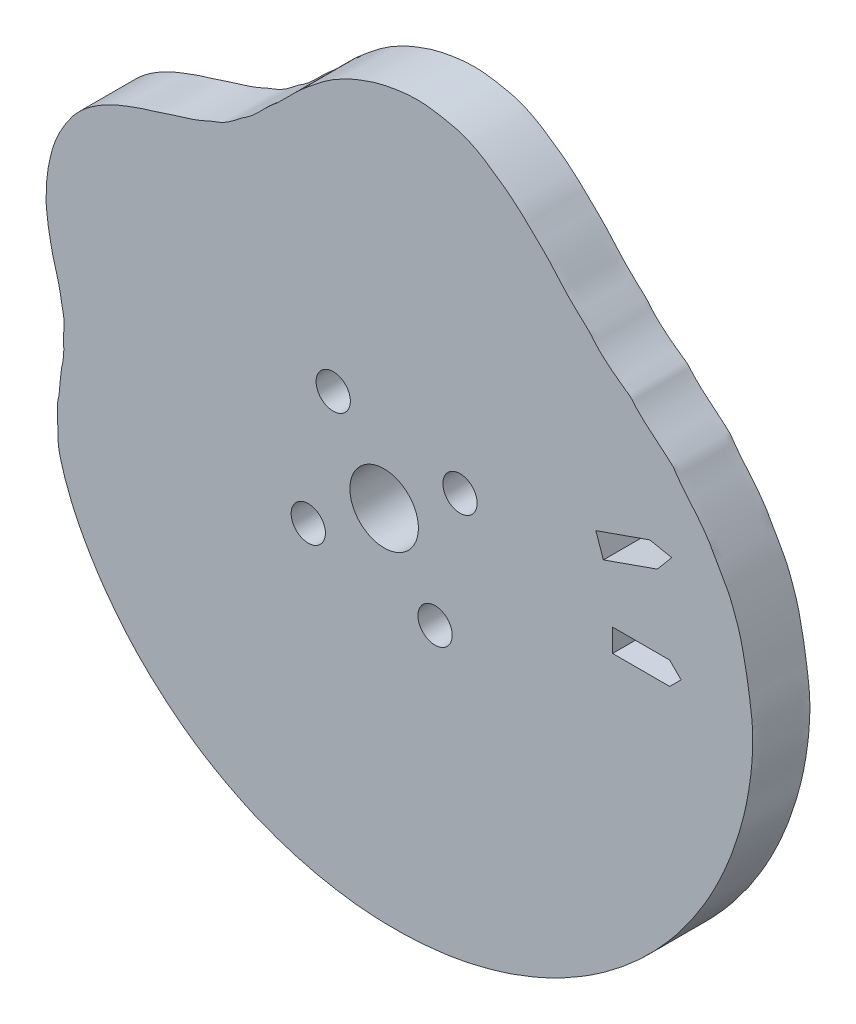
from build123d import *

# Parameters (mm, degrees)
EXTRUDE_1_DEPTH     = 5
CUT_EXTRUDE_1_DEPTH = 5
SKETCH_5_R          = 3
CUT_EXTRUDE_2_DEPTH = 5
CUT_EXTRUDE_4_DEPTH = 10
SKETCH_8_R          = 1.5
CUT_EXTRUDE_5_DEPTH = 10


with BuildPart() as part:
    # 草图2 → 凸台-拉伸1 (new body)
    with BuildSketch(Plane.XY):
        with BuildLine():
            add(Edge.make_bspline(
                [(32.21, 0), (32.209521518, 0.05381096), (32.188278936, 0.156583769), (32.169721, 0.313258213), (32.150858506, 0.466787542), (32.12899956, 0.623201357), (32.111035792, 0.776800982), (32.088975474, 0.933201476), (32.07094037, 1.086785538), (32.049359423, 1.243260002), (32.028999879, 1.399833003), (32.014467813, 1.557933817), (31.975716676, 1.71209694), (31.960006739, 1.870001386), (31.944257059, 2.027897659), (31.905621072, 2.182084461), (31.890961756, 2.336798931), (31.872281755, 2.494233828), (31.835787092, 2.648811857), (31.824429651, 2.807927572), (31.788672352, 2.963078637), (31.756723614, 3.118967717), (31.744487693, 3.277936436), (31.70760517, 3.432904105), (31.681708402, 3.586988812), (31.648620644, 3.743068379), (31.620056654, 3.900011106), (31.591159575, 4.056888537), (31.559030905, 4.213156116), (31.528903799, 4.369745204), (31.505109281, 4.528582611), (31.453987341, 4.681213592), (31.436208254, 4.83883084), (31.383957663, 4.991205433), (31.365142359, 5.148596143), (31.317875919, 5.302797722), (31.278965063, 5.45571122), (31.250645239, 5.61415488), (31.214018235, 5.768862522), (31.157368534, 5.918196646), (31.118533512, 6.07296561), (31.084021029, 6.228799433), (31.029131926, 6.37974963), (30.980228183, 6.530065463), (30.929955344, 6.679988519), (30.879950443, 6.82998046), (30.830242884, 6.98008964), (30.779078019, 7.129660979), (30.733113999, 7.28236625), (30.666103239, 7.427334445), (30.625222027, 7.579916688), (30.556679473, 7.722001279), (30.500364484, 7.87013963), (30.441904283, 8.017456173), (30.380273746, 8.160120566), (30.316967522, 8.302046937), (30.264403434, 8.450129217), (30.189150732, 8.589630138), (30.119791219, 8.729871702), (30.052971839, 8.868217465), (29.976518302, 9.001512464), (29.912325266, 9.143029564), (29.830165422, 9.274922811), (29.759654912, 9.41499041), (29.680224282, 9.544929535), (29.611666265, 9.682873385), (29.529360596, 9.809633632), (29.449983651, 9.939990047), (29.3707048, 10.070406179), (29.288108057, 10.196989231), (29.221872821, 10.332998372), (29.13939538, 10.45965877), (29.06202554, 10.585865659), (28.987525982, 10.711953704), (28.920284361, 10.840158251), (28.849985644, 10.96998901), (28.779773062, 11.099885711), (28.710922109, 11.230468146), (28.637289153, 11.356952267), (28.583296202, 11.49527969), (28.501471932, 11.61776007), (28.419981711, 11.73994632), (28.340157051, 11.860121848), (28.259390084, 11.97956629), (28.181252898, 12.103242839), (28.088959129, 12.216915742), (28.009606325, 12.339683095), (27.934029097, 12.462138093), (27.835443808, 12.569812829), (27.754773886, 12.690347078), (27.654955295, 12.797115894), (27.58466757, 12.922590207), (27.488874678, 13.029166159), (27.400302166, 13.140223974), (27.309916656, 13.249937945), (27.22003121, 13.360024248), (27.129958505, 13.469965065), (27.040134772, 13.580115493), (26.949502409, 13.689572962), (26.863415891, 13.799598471), (26.766686024, 13.900488781), (26.679947119, 14.009955761), (26.593519851, 14.11968345), (26.495888362, 14.219819477), (26.414747114, 14.330682617), (26.31494872, 14.426519325), (26.245406855, 14.543747996), (26.144972365, 14.63657588), (26.071788203, 14.754003326), (25.982211751, 14.85576114), (25.897469292, 14.961407234), (25.819617828, 15.069722069), (25.744014708, 15.17967199), (25.655331107, 15.277616315), (25.592426172, 15.393961642), (25.508482482, 15.49668523), (25.440015596, 15.6100193), (25.372827886, 15.720966846), (25.288980674, 15.825159249), (25.192433331, 15.919291175), (25.089875688, 16.009860333), (24.989784092, 16.099748399), (24.889129936, 16.192864941), (24.783948691, 16.277425519), (24.677177831, 16.360015581), (24.579495367, 16.449358226), (24.482895799, 16.544354616), (24.366627175, 16.615082882), (24.274352187, 16.711840214), (24.165977931, 16.788581875), (24.073478811, 16.880768627), (23.969950258, 16.959940531), (23.866725185, 17.039475261), (23.773284944, 17.130536852), (23.670002459, 17.210002929), (23.566704972, 17.289451135), (23.47331125, 17.380568147), (23.369921818, 17.459907065), (23.267009383, 17.539812988), (23.173993421, 17.627422613), (23.076309539, 17.712933546), (22.983151, 17.796443452), (22.890001158, 17.88389422), (22.786634203, 17.955854534), (22.704219089, 18.051189928), (22.60641697, 18.129520914), (22.520099395, 18.220104306), (22.433196169, 18.310073112), (22.337087846, 18.390181576), (22.249989287, 18.476902121), (22.170638617, 18.573730605), (22.079591653, 18.656472423), (22.000397323, 18.750385911), (21.9202956, 18.840232958), (21.836687219, 18.930554467), (21.763065127, 19.029206124), (21.679311146, 19.122571054), (21.591973591, 19.20859214), (21.502292927, 19.293890799), (21.395734851, 19.357618641), (21.302538823, 19.444860391), (21.190709222, 19.506148746), (21.090294234, 19.580438498), (20.990344195, 19.650447183), (20.886658361, 19.71887531), (20.793413109, 19.801219303), (20.689321571, 19.869110352), (20.590977772, 19.941245403), (20.487236781, 20.00561675), (20.402673889, 20.094264129), (20.299477476, 20.159361671), (20.197302957, 20.229717356), (20.103761068, 20.307209149), (20.009395725, 20.383636798), (19.907421811, 20.445850192), (19.81982286, 20.533802838), (19.723997709, 20.6074969), (19.626647827, 20.679306499), (19.539978472, 20.763935248), (19.440358281, 20.83646598), (19.350276962, 20.92034598), (19.260401098, 21.000411414), (19.169978063, 21.076444848), (19.090281421, 21.163833419), (18.996396724, 21.239509034), (18.913715052, 21.327083223), (18.826871468, 21.41351001), (18.740214753, 21.497063658), (18.659878303, 21.589884712), (18.580285907, 21.683410635), (18.489564139, 21.766454807), (18.410815737, 21.860738072), (18.326901752, 21.950699785), (18.25288431, 22.046337765), (18.177215401, 22.143756743), (18.102524889, 22.238756769), (18.019697039, 22.332901459), (17.929291843, 22.419279336), (17.843059216, 22.509903474), (17.750070053, 22.590076293), (17.656652586, 22.669782656), (17.573332036, 22.760200611), (17.480001122, 22.840001151), (17.38666335, 22.919794653), (17.303364154, 23.010234524), (17.209871581, 23.089863806), (17.117164161, 23.170325778), (17.02982134, 23.259810522), (16.94353121, 23.350411698), (16.846050755, 23.429144958), (16.76396872, 23.520875682), (16.666376611, 23.599490608), (16.580552185, 23.690585352), (16.489843778, 23.779835319), (16.400072703, 23.87007337), (16.309865409, 23.9598712), (16.220465662, 24.050441831), (16.126519756, 24.140032436), (16.043440438, 24.239926615), (15.94971857, 24.329747694), (15.857717374, 24.421111381), (15.769101798, 24.516393249), (15.693889851, 24.623127339), (15.595982757, 24.709576065), (15.510509282, 24.810483205), (15.420415134, 24.910338681), (15.329315216, 25.006593016), (15.250717179, 25.113436977), (15.159411263, 25.209500588), (15.070149376, 25.310126617), (14.979991231, 25.409992942), (14.8898857, 25.509901614), (14.80046597, 25.610400601), (14.706516168, 25.710340813), (14.623562974, 25.819734193), (14.529167455, 25.919251981), (14.443085801, 26.01958382), (14.346703118, 26.113371012), (14.249762586, 26.206611432), (14.16032179, 26.313468016), (14.062862525, 26.406220002), (13.966800102, 26.5034597), (13.869971727, 26.599974207), (13.773307337, 26.696638314), (13.676785756, 26.79345913), (13.579488106, 26.889460377), (13.483490317, 26.99034554), (13.376511776, 27.079656668), (13.283753834, 27.177109944), (13.186653394, 27.273319127), (13.089541493, 27.369517637), (12.993417614, 27.470265569), (12.886743655, 27.559913051), (12.789593548, 27.659524339), (12.693119434, 27.763805872), (12.576886106, 27.846199985), (12.480378947, 27.95044658), (12.383358739, 28.050195207), (12.276212658, 28.139343526), (12.180284368, 28.243808437), (12.072532267, 28.335787115), (11.970334748, 28.434204446), (11.856082144, 28.515302269), (11.764317012, 28.625124854), (11.645777968, 28.704984812), (11.553445309, 28.814152119), (11.439397013, 28.899353217), (11.330746918, 28.986987837), (11.229107941, 29.082789154), (11.122959063, 29.170551509), (11.006831806, 29.249214815), (10.900051922, 29.340067905), (10.792964971, 29.430519405), (10.679408343, 29.509191914), (10.568898541, 29.59320849), (10.451594766, 29.667439719), (10.336655151, 29.749001331), (10.232393626, 29.844399439), (10.110703891, 29.916290438), (10.00008897, 30.000110336), (9.888929493, 30.083254901), (9.77070011, 30.15621307), (9.659467061, 30.244039532), (9.540183608, 30.315404955), (9.432311629, 30.40527243), (9.307860338, 30.464989381), (9.198961514, 30.553293538), (9.083117709, 30.631663975), (8.957838495, 30.69488812), (8.852013543, 30.784863822), (8.72922775, 30.848814628), (8.610212192, 30.920327283), (8.489923483, 30.98987624), (8.370093878, 31.060167757), (8.249701007, 31.129452731), (8.132456724, 31.201192444), (8.01021627, 31.260455463), (7.88666285, 31.316953385), (7.773399043, 31.397353947), (7.63934337, 31.434456858), (7.52017026, 31.500332384), (7.399962596, 31.564188236), (7.271958223, 31.606637874), (7.147928778, 31.66315366), (7.021964484, 31.706491459), (6.899527951, 31.764551515), (6.769568074, 31.798793054), (6.640255441, 31.84078855), (6.512464043, 31.877183014), (6.388819426, 31.924279771), (6.259710418, 31.948986553), (6.130065591, 31.980209046), (6.00002722, 32.010177261), (5.869825531, 32.039081908), (5.741279623, 32.073332848), (5.608757064, 32.086859644), (5.479987336, 32.119936219), (5.351293234, 32.153393674), (5.218545935, 32.165788606), (5.094603672, 32.203099746), (4.965418886, 32.217017658), (4.841326316, 32.253546546), (4.709811962, 32.269026586), (4.580051829, 32.290273427), (4.449980722, 32.309879707), (4.320025282, 32.330207744), (4.18991815, 32.349289315), (4.060678368, 32.372567226), (3.930020505, 32.38012763), (3.79923925, 32.38692001), (3.670748063, 32.41244772), (3.540170113, 32.422984947), (3.409721478, 32.415563827), (3.280305168, 32.434788735), (3.149697048, 32.42525743), (3.020267411, 32.444204663), (2.890000167, 32.437899086), (2.759731921, 32.444211406), (2.630305294, 32.425230398), (2.499686153, 32.434889889), (2.37362502, 32.415690129), (2.246406421, 32.423580712), (2.120009849, 32.409189121), (1.990107181, 32.399270327), (1.859179149, 32.393713347), (1.734161314, 32.366328798), (1.605824107, 32.363810109), (1.480903124, 32.335502778), (1.34920069, 32.333665615), (1.223261292, 32.310180928), (1.096837524, 32.289011313), (0.973130452, 32.271240752), (0.846886986, 32.248651944), (0.723068095, 32.231569463), (0.597077539, 32.207734076), (0.471646532, 32.195049), (0.351561522, 32.155758034), (0.225334796, 32.143325698), (0.104628335, 32.106860862), (-0.021398277, 32.093415941), (-0.139783541, 32.058975493), (-0.260121306, 32.030491901), (-0.379731235, 31.999056904), (-0.50186777, 31.973086129), (-0.618173432, 31.927059753), (-0.740069095, 31.900236129), (-0.861547063, 31.871985049), (-0.980004606, 31.829993706), (-1.095392612, 31.789117513), (-1.214562775, 31.760773988), (-1.327276584, 31.721667393), (-1.442493634, 31.677623029), (-1.557635317, 31.642733451), (-1.672126078, 31.596681295), (-1.790021382, 31.565216441), (-1.897480419, 31.507124396), (-2.010271894, 31.470655217), (-2.124285817, 31.42916753), (-2.237960991, 31.38297991), (-2.347298675, 31.326807715), (-2.460211872, 31.294892938), (-2.561997275, 31.237192927), (-2.667884744, 31.188067209), (-2.782172346, 31.152075819), (-2.88771319, 31.102081687), (-2.991930581, 31.047091228), (-3.098172307, 31.003148573), (-3.201810229, 30.946807544), (-3.308163902, 30.903146186), (-3.41194752, 30.847065748), (-3.517586955, 30.802045843), (-3.622724638, 30.751577522), (-3.717218164, 30.688279425), (-3.819965228, 30.639933003), (-3.922923921, 30.591994336), (-4.016764326, 30.527437847), (-4.122987002, 30.482111279), (-4.219723576, 30.419483902), (-4.315573533, 30.361437993), (-4.414306717, 30.308390986), (-4.508559831, 30.252965517), (-4.601152144, 30.186561576), (-4.698746083, 30.13328009), (-4.789606066, 30.069391515), (-4.884417202, 30.008265121), (-4.975745468, 29.941972946), (-5.069706021, 29.87960173), (-5.16322762, 29.821146574), (-5.246892392, 29.749003497), (-5.339736398, 29.689701035), (-5.431984344, 29.633567196), (-5.510745843, 29.556889987), (-5.596579615, 29.488595555), (-5.693032645, 29.435015364), (-5.766593529, 29.354527437), (-5.863056757, 29.304989283), (-5.94005742, 29.225951692), (-6.026081323, 29.162567138), (-6.112918213, 29.100272306), (-6.189860491, 29.029818715), (-6.271110274, 28.957319915), (-6.355846064, 28.892261402), (-6.442932706, 28.830291171), (-6.52005694, 28.760073883), (-6.596846284, 28.689422057), (-6.682800087, 28.630196707), (-6.76002189, 28.563597378), (-6.826871595, 28.485885554), (-6.914479277, 28.432094166), (-6.985497111, 28.357876665), (-7.073236397, 28.304247857), (-7.139558994, 28.225884857), (-7.216826406, 28.163483148), (-7.293367191, 28.096741779), (-7.369289644, 28.032777458), (-7.440565909, 27.960681416), (-7.506959196, 27.885976052), (-7.593106943, 27.834094458), (-7.659108032, 27.758970981), (-7.730238322, 27.690274993), (-7.799938678, 27.619929047), (-7.870006964, 27.550008818), (-7.940033467, 27.480035682), (-8.00985917, 27.409848456), (-8.080529854, 27.340570495), (-8.146476187, 27.269534063), (-8.223623867, 27.210558638), (-8.288917132, 27.138917137), (-8.360558849, 27.073624059), (-8.419533265, 26.996475455), (-8.490573741, 26.930532837), (-8.556538143, 26.863214), (-8.623370822, 26.796701385), (-8.689992698, 26.729993655), (-8.756656298, 26.663322182), (-8.823375728, 26.596711154), (-8.886486413, 26.533144531), (-8.95393734, 26.467299256), (-9.01578575, 26.398867508), (-9.094155749, 26.344195786), (-9.145710859, 26.265661131), (-9.220948973, 26.214553462), (-9.279358114, 26.145725839), (-9.350566697, 26.0942132), (-9.409397511, 26.025727454), (-9.480836605, 25.97459701), (-9.537035918, 25.90590332), (-9.613302333, 25.860878766), (-9.679983021, 25.803593764), (-9.736558524, 25.735377713), (-9.813969484, 25.695277043), (-9.866085387, 25.624777365), (-9.943163327, 25.584346487), (-9.999478231, 25.519341775), (-10.06037325, 25.456831399), (-10.129859416, 25.403440716), (-10.189485198, 25.339445902), (-10.250528131, 25.280569829), (-10.310071635, 25.21647791), (-10.379904709, 25.163496652), (-10.439577262, 25.099543505), (-10.500113269, 25.040122314), (-10.559969662, 24.97996724), (-10.620008082, 24.920008726), (-10.679998011, 24.859997855), (-10.739999875, 24.799999855), (-10.800002488, 24.740002727), (-10.859990172, 24.679989237), (-10.920036824, 24.620040324), (-10.979862532, 24.559849468), (-11.040513047, 24.500561803), (-11.096558595, 24.439564881), (-11.163342965, 24.390327325), (-11.220040182, 24.330043992), (-11.276502699, 24.269503706), (-11.343953827, 24.220996127), (-11.395938444, 24.158886234), (-11.463993776, 24.111038443), (-11.516414871, 24.049413602), (-11.580386881, 24.000402928), (-11.640246206, 23.950347126), (-11.700601901, 23.896446026), (-11.769897478, 23.854220332), (-11.82614377, 23.79816106), (-11.894164756, 23.762314223), (-11.947067866, 23.70436725), (-12.022972104, 23.675728912), (-12.077592282, 23.615083242), (-12.150789251, 23.581082111), (-12.217585057, 23.54166793), (-12.283543435, 23.501430138), (-12.337289311, 23.444691647), (-12.412750261, 23.415375403), (-12.466273077, 23.358258961), (-12.534647446, 23.318558658), (-12.598561883, 23.272416767), (-12.66031051, 23.220432331), (-12.716697224, 23.168905932), (-12.783333851, 23.13113299), (-12.839515613, 23.079349885), (-12.90007802, 23.030108579), (-12.960172307, 22.980215801), (-13.021229289, 22.927297822), (-13.08565278, 22.881865563), (-13.152869242, 22.840522341), (-13.210151729, 22.790204615), (-13.266547121, 22.738690593), (-13.334035074, 22.702138907), (-13.387170744, 22.644525007), (-13.462695253, 22.615278636), (-13.516586277, 22.558771569), (-13.581931056, 22.517584477), (-13.648739067, 22.483389263), (-13.711122753, 22.436413232), (-13.778843318, 22.40352236), (-13.841413047, 22.356899498), (-13.90994004, 22.319872079), (-13.978814131, 22.283585177), (-14.039237219, 22.235828679), (-14.110198697, 22.210293656), (-14.182635966, 22.181993831), (-14.247218122, 22.137724216), (-14.320475191, 22.111008538), (-14.392280329, 22.077443272), (-14.467550247, 22.052133788), (-14.54024708, 22.020794505), (-14.610509986, 21.984949182), (-14.689612689, 21.975353698), (-14.761955156, 21.936366862), (-14.837703422, 21.912631636), (-14.909974136, 21.8799229), (-14.98240634, 21.847695556), (-15.057630768, 21.822398808), (-15.129867668, 21.789674812), (-15.200078329, 21.760179533), (-15.269819014, 21.729607057), (-15.344763955, 21.699751637), (-15.41525246, 21.660286105), (-15.490115252, 21.630241807), (-15.560172707, 21.600397647), (-15.631998085, 21.566858177), (-15.710612236, 21.54505509), (-15.777237656, 21.497787323), (-15.852826655, 21.468537201), (-15.927486336, 21.442090973), (-16.000034697, 21.410073864), (-16.072366417, 21.377595563), (-16.147728834, 21.352645336), (-16.222363597, 21.317581656), (-16.300032079, 21.290094976), (-16.377515059, 21.262059077), (-16.45266602, 21.228523718), (-16.527983659, 21.196862823), (-16.609461184, 21.184980868), (-16.682024226, 21.14648993), (-16.760535414, 21.121612748), (-16.83787504, 21.086536636), (-16.922299456, 21.074043829), (-16.997651277, 21.035791662), (-17.08236277, 21.024257436), (-17.157627757, 20.985701749), (-17.242394451, 20.974405349), (-17.320442868, 20.93366294), (-17.409526595, 20.926247204), (-17.487740997, 20.885993212), (-17.574999921, 20.872327224), (-17.655307027, 20.838678222), (-17.740005862, 20.820020438), (-17.824667764, 20.801233875), (-17.905096781, 20.768009959), (-17.9919482, 20.752923072), (-18.072545449, 20.71776139), (-18.155391009, 20.688940781), (-18.241848332, 20.672649281), (-18.319770547, 20.639215099), (-18.402935985, 20.609026274), (-18.485264119, 20.57854409), (-18.571987467, 20.563051033), (-18.652192457, 20.526623084), (-18.737804815, 20.503368774), (-18.818024166, 20.46698369), (-18.904690584, 20.451320704), (-18.987253767, 20.421540116), (-19.072523326, 20.387753698), (-19.157485327, 20.362270967), (-19.242707184, 20.328348574), (-19.32546765, 20.299130348), (-19.414549448, 20.280926412), (-19.497192751, 20.25131924), (-19.582866742, 20.218897802), (-19.668170813, 20.186733078), (-19.759096201, 20.174858982), (-19.842332076, 20.136989986), (-19.930107543, 20.110302711), (-20.020245176, 20.080884793), (-20.108079035, 20.046484254), (-20.199139363, 20.034994381), (-20.282245327, 19.996684285), (-20.370448675, 19.971525646), (-20.458150591, 19.936681474), (-20.551817567, 19.923219389), (-20.63971705, 19.888990328), (-20.730147573, 19.860494789), (-20.822692565, 19.827976413), (-20.917239164, 19.801771913), (-21.010151276, 19.770606891), (-21.098308145, 19.737128157), (-21.191481545, 19.722338125), (-21.282092072, 19.691783539), (-21.367709548, 19.647500102), (-21.460307998, 19.620775282), (-21.549895378, 19.589734448), (-21.640110489, 19.560286926), (-21.729662665, 19.529117847), (-21.822403722, 19.502912533), (-21.910287681, 19.455102927), (-22.007252165, 19.431878411), (-22.102272648, 19.40247692), (-22.187331426, 19.356465622), (-22.282767812, 19.33379997), (-22.367212079, 19.28614406), (-22.462765447, 19.263804016), (-22.547348878, 19.21646963), (-22.645233152, 19.191782003), (-22.734843278, 19.148414931), (-22.832325725, 19.122691935), (-22.919591993, 19.078938281), (-23.010388814, 19.041012192), (-23.09776883, 18.99755206), (-23.194792704, 18.97064573), (-23.287369132, 18.931590833), (-23.379961178, 18.889924603), (-23.469985815, 18.849970905), (-23.560095564, 18.810191777), (-23.649631931, 18.769261988), (-23.742763982, 18.73220833), (-23.82732066, 18.677961299), (-23.919970252, 18.639940755), (-24.012801032, 18.602281056), (-24.096797706, 18.546918751), (-24.19333253, 18.513327129), (-24.27651798, 18.456433271), (-24.371160562, 18.425139336), (-24.451173503, 18.366207214), (-24.540098366, 18.320203102), (-24.628449498, 18.273014375), (-24.711296167, 18.216547663), (-24.798756123, 18.17354456), (-24.881310568, 18.116562451), (-24.968339365, 18.072867519), (-25.054316677, 18.018137529), (-25.134998668, 17.960798317), (-25.223728631, 17.912169762), (-25.29750279, 17.844386482), (-25.392546817, 17.80568403), (-25.466038595, 17.737499374), (-25.553455871, 17.69172254), (-25.629466006, 17.629216811), (-25.710141788, 17.570208225), (-25.789966843, 17.509950291), (-25.869990841, 17.449990612), (-25.950069794, 17.390087262), (-26.029729982, 17.329660341), (-26.108895754, 17.272790372), (-26.183972878, 17.207400119), (-26.256087658, 17.138592463), (-26.343166093, 17.084158894), (-26.406213969, 17.009179875), (-26.484055238, 16.947499591), (-26.559365781, 16.882871942), (-26.629678323, 16.809665139), (-26.700232613, 16.740225313), (-26.769391224, 16.669433611), (-26.840535468, 16.603583224), (-26.89921077, 16.526182421), (-26.973844382, 16.460242189), (-27.035943156, 16.382699733), (-27.104084195, 16.31001843), (-27.155396804, 16.226482692), (-27.234419267, 16.163350952), (-27.288223853, 16.07858626), (-27.351646555, 16.003463693), (-27.398674144, 15.916791612), (-27.460035653, 15.840028155), (-27.521187282, 15.763098955), (-27.568820749, 15.676905341), (-27.629920762, 15.599948529), (-27.691487232, 15.523294718), (-27.737774136, 15.4362264), (-27.804753979, 15.361911468), (-27.847067999, 15.271604201), (-27.89882011, 15.186903288), (-27.964628084, 15.111836765), (-28.006459546, 15.021183554), (-28.06013169, 14.940093664), (-28.11298964, 14.858424679), (-28.156615985, 14.771340473), (-28.213239627, 14.688571008), (-28.259115979, 14.599503056), (-28.309316151, 14.514739006), (-28.350869152, 14.425360562), (-28.399753066, 14.339889256), (-28.451594323, 14.252455071), (-28.489250038, 14.159624947), (-28.530844615, 14.070427914), (-28.567923823, 13.977275832), (-28.621375612, 13.892449266), (-28.661952295, 13.801969572), (-28.687675515, 13.707827011), (-28.729974037, 13.619986973), (-28.772426428, 13.53222414), (-28.798497317, 13.434876051), (-28.841755838, 13.345217608), (-28.86649578, 13.247377114), (-28.915284509, 13.159861633), (-28.937196265, 13.062381266), (-28.970145368, 12.970066475), (-29.002193043, 12.87733947), (-29.026723869, 12.782363801), (-29.065511449, 12.689028943), (-29.073748473, 12.590784728), (-29.116410127, 12.49925438), (-29.123635209, 12.400760639), (-29.166040434, 12.309145344), (-29.175638855, 12.208051828), (-29.211449997, 12.114581377), (-29.231567397, 12.017019319), (-29.245046102, 11.921142602), (-29.285125303, 11.828900849), (-29.297520386, 11.732749437), (-29.321611177, 11.63702762), (-29.340186622, 11.54001867), (-29.357678148, 11.442901281), (-29.384676943, 11.347961335), (-29.385486917, 11.252062894), (-29.411564491, 11.156986735), (-29.432218242, 11.064183761), (-29.436967995, 10.965686376), (-29.463823026, 10.871070577), (-29.468092636, 10.77307633), (-29.482060664, 10.67695291), (-29.485176008, 10.582037918), (-29.51487395, 10.487954853), (-29.517766619, 10.389755427), (-29.533571285, 10.293707663), (-29.526645029, 10.196329451), (-29.540479756, 10.103318822), (-29.549485629, 10.006681072), (-29.563547025, 9.91367114), (-29.555754884, 9.816290265), (-29.574393789, 9.723718231), (-29.565785646, 9.626290727), (-29.583240843, 9.533659599), (-29.579981489, 9.436671253), (-29.576217166, 9.342937802), (-29.593964496, 9.24707126), (-29.589015814, 9.153278727), (-29.590251164, 9.060013925), (-29.589923714, 8.966662478), (-29.590020494, 8.873334293), (-29.589989859, 8.780000024), (-29.590021166, 8.689998977), (-29.589921935, 8.596670922), (-29.590312152, 8.503316156), (-29.58896758, 8.410056846), (-29.593875594, 8.31960198), (-29.575471239, 8.230430771), (-29.584611787, 8.136263159), (-29.565563434, 8.043727137), (-29.573775138, 7.949610967), (-29.558980332, 7.860055222), (-29.550273311, 7.769985188), (-29.539926426, 7.680004026), (-29.530020985, 7.589998708), (-29.519989632, 7.500001142), (-29.510020486, 7.409996722), (-29.499928425, 7.320011968), (-29.490265813, 7.229955406), (-29.479008323, 7.140166409), (-29.473668824, 7.04883035), (-29.446800439, 6.964458539), (-29.443365613, 6.875513583), (-29.415334474, 6.791336985), (-29.414683693, 6.698659748), (-29.386545918, 6.614502322), (-29.383505723, 6.525486418), (-29.355006342, 6.441407835), (-29.355794746, 6.351702698), (-29.324218794, 6.268304491), (-29.324890249, 6.181844824), (-29.298103275, 6.097091646), (-29.278309958, 6.014186978), (-29.271702949, 5.92581208), (-29.25182203, 5.842913804), (-29.226359867, 5.761310873), (-29.224385623, 5.678562489), (-29.194343065, 5.59829021), (-29.194624094, 5.511903328), (-29.169931143, 5.430005608), (-29.14660816, 5.351258122), (-29.144288541, 5.268575759), (-29.115657313, 5.191433968), (-29.113656556, 5.108694325), (-29.089036301, 5.030179876), (-29.070013797, 4.949997975), (-29.050908513, 4.869828226), (-29.026534749, 4.791277592), (-29.023643021, 4.708668741), (-28.998174059, 4.630448738), (-28.983292937, 4.547969275), (-28.946961113, 4.471978817), (-28.930617054, 4.389798263), (-28.911540338, 4.312929515), (-28.888310856, 4.237115873), (-28.870270446, 4.159931033), (-28.84987421, 4.080023251), (-28.83099976, 4.003101997), (-28.810609896, 3.925349274), (-28.779445771, 3.854635842), (-28.758765454, 3.776960782), (-28.741873599, 3.702840542), (-28.717980391, 3.627204863), (-28.702064044, 3.552781266), (-28.677929643, 3.477220877), (-28.662055473, 3.402782962), (-28.638001862, 3.327201735), (-28.62174463, 3.252866061), (-28.599988648, 3.180003371), (-28.578303792, 3.107119561), (-28.561814301, 3.03285285), (-28.539514493, 2.960112705), (-28.521072366, 2.88977767), (-28.495305169, 2.818305543), (-28.49444904, 2.74174758), (-28.469994299, 2.669991792), (-28.446644906, 2.601428718), (-28.444268814, 2.52837821), (-28.415526887, 2.461664863), (-28.414347426, 2.388362066), (-28.386378309, 2.321483139), (-28.381000512, 2.249786642), (-28.36967212, 2.18006992), (-28.360311009, 2.109933678), (-28.349083846, 2.040195367), (-28.343297141, 1.968586079), (-28.31689014, 1.901373995), (-28.310017085, 1.829996306), (-28.303040512, 1.758641), (-28.276950184, 1.691360446), (-28.270027582, 1.619996755), (-28.262937856, 1.548652725), (-28.238538863, 1.484418759), (-28.229033386, 1.41681072), (-28.223210062, 1.348616862), (-28.197001115, 1.281339705), (-28.189671175, 1.210099527), (-28.184571714, 1.141460919), (-28.155424152, 1.078539401), (-28.15035303, 1.009898596), (-28.142906094, 0.938667489), (-28.118332212, 0.874461108), (-28.109769307, 0.806654145), (-28.099974903, 0.740017651), (-28.089852471, 0.670019008), (-28.081045568, 0.603172808), (-28.068965309, 0.53682507), (-28.0600802, 0.469994133), (-28.050736308, 0.403196759), (-28.039904155, 0.336757715), (-28.026004262, 0.270521247), (-28.035045065, 0.202653141), (-28.01479608, 0.137360365), (-28.024968907, 0.069396013), (-28.006667419, 0.003810627), (-28.010976421, -0.063405233), (-28.009768757, -0.129976197), (-28.009882481, -0.196683179), (-28.010589605, -0.26329185), (-28.007282111, -0.330416858), (-28.019622894, -0.39678165), (-28.030793743, -0.463188638), (-28.040182369, -0.530001085), (-28.048935564, -0.600071864), (-28.063310957, -0.666195311), (-28.056227117, -0.733838102), (-28.073918078, -0.799484743), (-28.069124243, -0.866728842), (-28.070261587, -0.933314906), (-28.069920399, -1.00000495), (-28.070034075, -1.066666708), (-28.069936785, -1.133329549), (-28.070260916, -1.200018341), (-28.069094099, -1.266602327), (-28.073057703, -1.333787532), (-28.056279673, -1.399498644), (-28.060851198, -1.466727404), (-28.059681417, -1.533309866), (-28.060390092, -1.600031406), (-28.05879365, -1.669900586), (-28.064188893, -1.737288452), (-28.045802008, -1.802712487), (-28.051261867, -1.870093682), (-28.049488559, -1.936661869), (-28.05089949, -2.00328164), (-28.046307346, -2.07049581), (-28.063731773, -2.139498771), (-28.058918666, -2.206743552), (-28.061132717, -2.27325206), (-28.05594719, -2.340528641), (-28.074915213, -2.409399803), (-28.064816995, -2.477359642), (-28.085009972, -2.542652899), (-28.076144812, -2.610523368), (-28.090061031, -2.6799976), (-28.10361229, -2.749486185), (-28.095783838, -2.817315883), (-28.112559619, -2.882977394), (-28.116950452, -2.951313289), (-28.140811151, -3.01984), (-28.160035529, -3.089988947), (-28.179046733, -3.160204213), (-28.20354083, -3.228533872), (-28.205908928, -3.301583299), (-28.233549582, -3.368532181), (-28.239035786, -3.440205808), (-28.250253739, -3.509945182), (-28.259949258, -3.580013463), (-28.269949231, -3.650000967), (-28.280253819, -3.719982669), (-28.289035491, -3.790068356), (-28.303555407, -3.859510483), (-28.296630792, -3.930476321), (-28.310020245, -3.999998565), (-28.323288635, -4.06952939), (-28.316724778, -4.140469656), (-28.329911736, -4.210006273), (-28.343626503, -4.27950538), (-28.335489831, -4.350557421), (-28.354505443, -4.419442915), (-28.346396894, -4.490492958), (-28.359998309, -4.56000012), (-28.373609837, -4.629506564), (-28.365471153, -4.700558748), (-28.384597736, -4.769436356), (-28.376049173, -4.840517672), (-28.391312703, -4.9099067), (-28.398751322, -4.980088774), (-28.413631988, -5.049504865), (-28.406605264, -5.12047861), (-28.42004551, -5.189995024), (-28.433213609, -5.259541194), (-28.42670645, -5.333749517), (-28.4404826, -5.406678806), (-28.448618798, -5.480127753), (-28.464625208, -5.549298955), (-28.452675206, -5.621969334), (-28.486843249, -5.691398141), (-28.484458265, -5.768458162), (-28.513285609, -5.84255964), (-28.527093668, -5.917379502), (-28.552752761, -5.988681246), (-28.560055779, -6.06340304), (-28.569086294, -6.136765179), (-28.581277318, -6.213186043), (-28.587864173, -6.286875994), (-28.603920876, -6.35947743), (-28.595623146, -6.430549789), (-28.614524687, -6.502774496), (-28.608617313, -6.576764257), (-28.611238522, -6.649914561), (-28.606292771, -6.72049052), (-28.624503109, -6.792815655), (-28.617854549, -6.866660146), (-28.623862463, -6.940474088), (-28.60634398, -7.009513166), (-28.611069623, -7.083406277), (-28.610018433, -7.156668726), (-28.609118571, -7.229937169), (-28.613563177, -7.300490171), (-28.595730206, -7.372792979), (-28.601309626, -7.446759746), (-28.598814857, -7.519915764), (-28.603560351, -7.590489956), (-28.586066889, -7.662816777), (-28.589841032, -7.736655959), (-28.593552938, -7.810487493), (-28.575670635, -7.879462596), (-28.584229214, -7.953813277), (-28.56686436, -8.026264223), (-28.569937917, -8.103321216), (-28.574199285, -8.177201812), (-28.555703052, -8.249464372), (-28.564290401, -8.323817756), (-28.546548634, -8.396241904), (-28.551012466, -8.473397058), (-28.549755583, -8.546651295), (-28.550067101, -8.623337515), (-28.550001536, -8.700000278), (-28.549927139, -8.776661442), (-28.550262945, -8.85335206), (-28.548850201, -8.929918161), (-28.554064864, -9.007192872), (-28.536054816, -9.082814587), (-28.540247254, -9.156690256), (-28.542264778, -9.2336813), (-28.528849557, -9.309920148), (-28.522012889, -9.386852777), (-28.50592679, -9.462823543), (-28.513403872, -9.537054941), (-28.500865115, -9.614297046), (-28.478558314, -9.685689679), (-28.469022497, -9.763207935), (-28.463542942, -9.841281671), (-28.437027887, -9.915440639), (-28.433153423, -9.994598385), (-28.405339784, -10.068477856), (-28.404879548, -10.148340532), (-28.377336108, -10.222698855), (-28.360273512, -10.300050746), (-28.341633932, -10.377110051), (-28.318237138, -10.452857451), (-28.300495445, -10.530143077), (-28.27906007, -10.609711084), (-28.263074131, -10.691991258), (-28.226908886, -10.768011753), (-28.211633833, -10.847100246), (-28.190748838, -10.924679608), (-28.156601088, -10.997903574), (-28.142418384, -11.085035816), (-28.107475646, -11.16493397), (-28.093841597, -11.252222644), (-28.05614784, -11.327765312), (-28.043064535, -11.411992218), (-28.009849339, -11.489950167), (-27.977527608, -11.568203642), (-27.961241849, -11.654666902), (-27.931177362, -11.737123485), (-27.900247005, -11.820077668), (-27.867780105, -11.902548702), (-27.842323649, -11.987495829), (-27.809304357, -12.069729777), (-27.780221585, -12.15478786), (-27.740073473, -12.235315364), (-27.70841295, -12.322804912), (-27.681623593, -12.407209151), (-27.649758956, -12.494620151), (-27.610486089, -12.575484466), (-27.577326029, -12.66234241), (-27.555586343, -12.750346068), (-27.503647874, -12.829327086), (-27.486415381, -12.920697994), (-27.434115261, -12.999535622), (-27.412856004, -13.09240367), (-27.372591038, -13.17789082), (-27.325186361, -13.259952013), (-27.303218822, -13.352583508), (-27.258603237, -13.439414423), (-27.222941088, -13.528036988), (-27.177208315, -13.612020914), (-27.14054092, -13.700253892), (-27.099469956, -13.789750135), (-27.062739302, -13.877959687), (-27.017245038, -13.962031943), (-26.980619749, -14.050297813), (-26.939119248, -14.139564463), (-26.902355637, -14.232833648), (-26.847508006, -14.317106245), (-26.812606962, -14.40789475), (-26.76913038, -14.494636553), (-26.717607608, -14.577132994), (-26.682108853, -14.672717481), (-26.629984959, -14.759991653), (-26.577950008, -14.847315183), (-26.542192142, -14.942755877), (-26.489258568, -15.029630186), (-26.439996676, -15.119998442), (-26.39075473, -15.210376045), (-26.33776218, -15.29722272), (-26.302214586, -15.392761939), (-26.24936891, -15.479705593), (-26.199534151, -15.56969177), (-26.151700983, -15.663076481), (-26.08826334, -15.746906846), (-26.040632372, -15.840386048), (-25.989997321, -15.929998242), (-25.939378345, -16.019620985), (-25.89169834, -16.113068003), (-25.828446287, -16.197020175), (-25.779946612, -16.289967447), (-25.731772666, -16.383113333), (-25.667510459, -16.46644956), (-25.622667616, -16.563659019), (-25.557291446, -16.646316019), (-25.512684467, -16.743669294), (-25.447458976, -16.826418169), (-25.402025556, -16.923267529), (-25.338996097, -17.00938788), (-25.280961529, -17.100586283), (-25.218182236, -17.186859169), (-25.171778277, -17.283116754), (-25.109250099, -17.369542754), (-25.050200979, -17.460122551), (-24.989945984, -17.549967044), (-24.930015086, -17.640009274), (-24.869993674, -17.729995861), (-24.810010219, -17.820007284), (-24.749965451, -17.909975003), (-24.690127979, -18.000092702), (-24.629522635, -18.089654187), (-24.57074036, -18.182942832), (-24.502511579, -18.266029324), (-24.436706285, -18.351002795), (-24.381804359, -18.443696216), (-24.307936524, -18.526111707), (-24.252134827, -18.623941707), (-24.177819374, -18.706022112), (-24.122280837, -18.804060011), (-24.047336719, -18.885625229), (-23.995219939, -18.9831802), (-23.914910343, -19.05691374), (-23.861981322, -19.153883043), (-23.789140109, -19.239366309), (-23.720190568, -19.330139409), (-23.65009762, -19.420076056), (-23.58231541, -19.505889406), (-23.517671098, -19.594098546), (-23.449983612, -19.679996477), (-23.379502045, -19.769586123), (-23.313530747, -19.859582035), (-23.236180522, -19.940177527), (-23.170864846, -20.03349307), (-23.09269862, -20.116112303), (-23.01740564, -20.201210511), (-22.949323685, -20.289381811), (-22.883897216, -20.38305539), (-22.796244254, -20.457073286), (-22.729961241, -20.549967785), (-22.663910183, -20.643055078), (-22.57556494, -20.716497568), (-22.511512669, -20.814089984), (-22.432180077, -20.895670987), (-22.357361676, -20.983938211), (-22.282887391, -21.066282929), (-22.20671714, -21.153349877), (-22.133410753, -21.239888595), (-22.046565241, -21.320089229), (-21.973407717, -21.406765463), (-21.896678279, -21.493315848), (-21.822934374, -21.579437652), (-21.740140906, -21.660131781), (-21.65648387, -21.740018267), (-21.583958549, -21.830399124), (-21.496022695, -21.909583133), (-21.423616022, -22.000076232), (-21.33950591, -22.079534101), (-21.256818769, -22.163476831), (-21.173293218, -22.246628517), (-21.090018491, -22.330018493), (-21.009963805, -22.409961912), (-20.926799724, -22.493474356), (-20.842797018, -22.576097899), (-20.7600802, -22.663620224), (-20.669542721, -22.735979859), (-20.590549117, -22.824117541), (-20.499430685, -22.895861038), (-20.420552235, -22.984120848), (-20.329541846, -23.05597893), (-20.250127001, -23.143669866), (-20.159344618, -23.219304931), (-20.07062772, -23.300665737), (-19.980007967, -23.37647325), (-19.899967174, -23.463500452), (-19.809507972, -23.539477812), (-19.720140773, -23.620150663), (-19.629928935, -23.699919535), (-19.540143488, -23.780171198), (-19.449497113, -23.859395672), (-19.363420141, -23.940778669), (-19.266625843, -24.009275397), (-19.180254618, -24.090312416), (-19.088904775, -24.172642707), (-18.994180434, -24.247729773), (-18.896725421, -24.319397527), (-18.809431569, -24.403273011), (-18.714230243, -24.477807483), (-18.616130615, -24.548621393), (-18.533397737, -24.635162344), (-18.426236939, -24.694358073), (-18.34380368, -24.78569788), (-18.236396375, -24.844554048), (-18.152776264, -24.934399263), (-18.049924535, -24.99990387), (-17.947523558, -25.06598266), (-17.862563372, -25.154120843), (-17.759632449, -25.219568651), (-17.656783923, -25.289019733), (-17.563675752, -25.371587297), (-17.460498178, -25.436165272), (-17.369132978, -25.513341465), (-17.270053572, -25.580064148), (-17.166762034, -25.649012196), (-17.073303019, -25.731073177), (-16.969642205, -25.799536594), (-16.869798383, -25.869677337), (-16.768923697, -25.943391348), (-16.660661328, -26.005975179), (-16.563527985, -26.082089025), (-16.456479805, -26.13792395), (-16.359296001, -26.213953751), (-16.251245972, -26.276891241), (-16.149613775, -26.349343594), (-16.05169915, -26.424785556), (-15.938106179, -26.47492744), (-15.839145433, -26.553776301), (-15.734175505, -26.618057184), (-15.625411347, -26.681293965), (-15.52471898, -26.7489113), (-15.415240201, -26.811022555), (-15.314817405, -26.879076719), (-15.205022757, -26.940643626), (-15.103283399, -27.012213379), (-14.986784992, -27.067901844), (-14.884630969, -27.138772982), (-14.777856953, -27.202107331), (-14.670277769, -27.260457397), (-14.55697687, -27.318213186), (-14.453051487, -27.391837653), (-14.3395881, -27.449302129), (-14.230110338, -27.510186938), (-14.11997055, -27.569950117), (-14.010007464, -27.630012594), (-13.899999594, -27.689999508), (-13.789994158, -27.749989373), (-13.680023773, -27.810042998), (-13.569910751, -27.869838634), (-13.45774917, -27.932035396), (-13.344796119, -27.989723301), (-13.227340101, -28.038005286), (-13.118087496, -28.102713237), (-13.00484958, -28.159848342), (-12.88687449, -28.207008301), (-12.781218476, -28.27613614), (-12.658594368, -28.313455394), (-12.55145195, -28.386645962), (-12.428541184, -28.423337929), (-12.321438732, -28.496622263), (-12.198652267, -28.533560604), (-12.091020154, -28.605780559), (-11.971679079, -28.646314798), (-11.857800634, -28.702600016), (-11.740372294, -28.750740875), (-11.61935905, -28.795055008), (-11.510669129, -28.86500502), (-11.389479335, -28.908943051), (-11.269935109, -28.959758785), (-11.154737699, -29.010286008), (-11.035239873, -29.049669547), (-10.920194956, -29.100498962), (-10.800028072, -29.15008079), (-10.679692757, -29.199177879), (-10.562266989, -29.25272158), (-10.437797024, -29.287449676), (-10.319974646, -29.339932324), (-10.202303024, -29.392817375), (-10.077388927, -29.426359985), (-9.962676886, -29.483815475), (-9.837376746, -29.516328879), (-9.722335434, -29.572898115), (-9.599845835, -29.609609445), (-9.475343135, -29.649633022), (-9.35472731, -29.700552803), (-9.229846041, -29.739577767), (-9.109961217, -29.779863429), (-8.987306196, -29.822000128), (-8.862678514, -29.857955627), (-8.74010789, -29.900336545), (-8.619890755, -29.939660605), (-8.497328465, -29.982059055), (-8.37266588, -30.017941124), (-8.247134942, -30.061376582), (-8.124631051, -30.101323726), (-7.998209488, -30.127184431), (-7.877311179, -30.172008883), (-7.754559464, -30.211108437), (-7.62520804, -30.238084581), (-7.504858721, -30.282152697), (-7.375136424, -30.3078107), (-7.251767311, -30.353240686), (-7.12294764, -30.378397446), (-6.995482633, -30.409120953), (-6.874569349, -30.451072275), (-6.746817465, -30.480729396), (-6.620059114, -30.510217678), (-6.492954696, -30.538431621), (-6.36703485, -30.571530014), (-6.239999036, -30.59999573), (-6.112968864, -30.628486445), (-5.987032917, -30.661513481), (-5.859991059, -30.69000468), (-5.729839712, -30.719177183), (-5.604446346, -30.752284279), (-5.475433909, -30.767094958), (-5.351447522, -30.80417732), (-5.21869483, -30.816545177), (-5.090067999, -30.850347833), (-4.961035099, -30.882073331), (-4.830112302, -30.900526065), (-4.701739928, -30.915432542), (-4.578280858, -30.95467608), (-4.449774384, -30.96888178), (-4.320017832, -30.990084633), (-4.190154289, -31.010779688), (-4.058739493, -31.026873219), (-3.931180311, -31.062417524), (-3.800617073, -31.082638066), (-3.669254781, -31.086699383), (-3.540091588, -31.110839553), (-3.410002839, -31.130012685), (-3.279897055, -31.149109707), (-3.150784821, -31.173477546), (-3.019236713, -31.176708702), (-2.889993943, -31.19994757), (-2.760787407, -31.223500104), (-2.629131229, -31.225795724), (-2.500792608, -31.253535706), (-2.369972059, -31.25979541), (-2.236025211, -31.267475131), (-2.104000277, -31.292746085), (-1.969914116, -31.299216672), (-1.840022992, -31.310209656), (-1.709993916, -31.319944703), (-1.580001342, -31.330011531), (-1.450000714, -31.340009171), (-1.3199958, -31.349951784), (-1.186702179, -31.360444562), (-1.053305808, -31.369763851), (-0.919968155, -31.379107704), (-0.790264045, -31.393558826), (-0.659742517, -31.386624368), (-0.529998899, -31.399972537), (-0.39694183, -31.413831123), (-0.263028227, -31.405388935), (-0.130264052, -31.423542125), (1.612e-06, -31.419958026), (0.130257593, -31.416626021), (0.259734954, -31.433568043), (0.39337325, -31.428960579), (0.526656513, -31.430264593), (0.660002623, -31.429931013), (0.789999344, -31.430019696), (0.920000001, -31.429990203), (1.053334001, -31.430020242), (1.186663842, -31.429925723), (1.320009729, -31.430253505), (1.449963597, -31.429052063), (1.580264071, -31.433542661), (1.713064041, -31.416321386), (1.846662519, -31.419891998), (1.980264984, -31.423566424), (2.109707574, -31.405719021), (2.240265582, -31.413582013), (2.369997133, -31.399925319), (2.503066221, -31.386378245), (2.636942365, -31.393845035), (2.769963986, -31.379063525), (2.900009995, -31.370255529), (3.029996034, -31.359914359), (3.160005867, -31.350087035), (3.293294271, -31.339473633), (3.426707273, -31.330537156), (3.559987165, -31.319864279), (3.690030502, -31.310271075), (3.819890826, -31.299051422), (3.950788385, -31.293507049), (4.079230902, -31.266668223), (4.210013914, -31.260082877), (4.344008817, -31.252820188), (4.475871473, -31.226140836), (4.610904169, -31.22455254), (4.739094599, -31.195464887), (4.87082292, -31.193811743), (4.999887605, -31.169023979), (5.130002401, -31.150020176), (5.260102789, -31.130895315), (5.389210574, -31.106469673), (5.520781736, -31.10349611), (5.649936131, -31.079277881), (5.779849741, -31.059321859), (5.911290549, -31.0433587), (6.038694083, -31.006540334), (6.170225585, -30.991173012), (6.299777501, -30.968840764), (6.431290397, -30.953390392), (6.558769025, -30.916907203), (6.689931251, -30.89970061), (6.818281056, -30.884676672), (6.941600442, -30.844706114), (7.071344784, -30.833610249), (7.199974569, -30.799882481), (7.32875622, -30.766856504), (7.461295373, -30.753397506), (7.589762266, -30.718821853), (7.717093807, -30.691823499), (7.842935274, -30.658330855), (7.970075967, -30.630319531), (8.099926454, -30.599693585), (8.227052974, -30.571605477), (8.352948552, -30.538405978), (8.480065057, -30.510242693), (8.606800704, -30.480658625), (8.734628119, -30.451320492), (8.858307049, -30.407034583), (8.986999073, -30.381402584), (9.114656947, -30.351406102), (9.237938506, -30.305752871), (9.369286473, -30.286004048), (9.4906752, -30.23388664), (9.619104266, -30.215298981), (9.742569741, -30.167545309), (9.865538287, -30.129239613), (9.994530425, -30.101002695), (10.117048528, -30.061108553), (10.240068961, -30.020236692), (10.362665243, -29.977909036), (10.487407289, -29.942312469), (10.612594874, -29.897695956), (10.737323113, -29.862045615), (10.859971726, -29.819921761), (10.98279424, -29.778279123), (11.106974589, -29.741112669), (11.232192502, -29.702481789), (11.347783986, -29.647431098), (11.470100331, -29.610243885), (11.594759471, -29.570642575), (11.714896405, -29.518439026), (11.84253649, -29.483463047), (11.957425794, -29.426452527), (12.082292998, -29.39279222), (12.199977208, -29.339938707), (12.317796941, -29.287449644), (12.442264891, -29.252715663), (12.559701531, -29.199202407), (12.679995174, -29.14998887), (12.800317772, -29.100842113), (12.91766833, -29.04713032), (13.042446494, -29.013111804), (13.159085637, -28.95789988), (13.280785264, -28.915307018), (13.389272848, -28.844848876), (13.510608378, -28.801279277), (13.629773839, -28.749502499), (13.747462586, -28.7018579), (13.86474527, -28.649631185), (13.977432807, -28.587722022), (14.097738771, -28.542466991), (14.214592632, -28.489274284), (14.325082063, -28.430019721), (14.444993205, -28.380143808), (14.554988584, -28.319815852), (14.675000124, -28.270162331), (14.785069627, -28.209977581), (14.904696636, -28.159552733), (15.017627528, -28.101771935), (15.130444207, -28.040954411), (15.239341363, -27.974997009), (15.360638152, -27.934961647), (15.469653083, -27.869241951), (15.581991319, -27.807458776), (15.698124482, -27.752783533), (15.809820462, -27.689656459), (15.920020344, -27.630044995), (16.030098164, -27.570163563), (16.139587001, -27.509300755), (16.253068296, -27.451866934), (16.356908775, -27.378093984), (16.470521451, -27.320884103), (16.579489203, -27.259133099), (16.693037087, -27.201818611), (16.797143306, -27.128474701), (16.909657521, -27.069479518), (17.021752264, -27.014868475), (17.11784656, -26.934454363), (17.233986543, -26.883344911), (17.336085222, -26.806776039), (17.451817479, -26.754979416), (17.550835425, -26.676186016), (17.655988814, -26.612202591), (17.764002042, -26.547784719), (17.869216723, -26.483886356), (17.967997127, -26.404763291), (18.082073092, -26.355345599), (18.180435572, -26.275574454), (18.288936534, -26.213421394), (18.389948946, -26.13991784), (18.491274639, -26.066918443), (18.598793063, -26.003184199), (18.69974223, -25.929613956), (18.799995797, -25.859994075), (18.90027458, -25.790409746), (19.001146382, -25.716730424), (19.108960783, -25.65341348), (19.209236584, -25.57893383), (19.313546298, -25.511417647), (19.406199516, -25.428246992), (19.50966543, -25.364053264), (19.600349635, -25.285966673), (19.703715922, -25.221641103), (19.796785407, -25.139021314), (19.899590362, -25.069513812), (20.002729993, -25.004338297), (20.086904784, -24.915175028), (20.194004223, -24.851943062), (20.285372326, -24.771669395), (20.384275067, -24.697868898), (20.475962, -24.622430985), (20.573569487, -24.546992029), (20.670066435, -24.47409343), (20.756905072, -24.385228275), (20.863079962, -24.324754166), (20.950008845, -24.235994895), (21.046138016, -24.162664788), (21.143002651, -24.090278531), (21.229550603, -24.009460769), (21.320355508, -23.930421141), (21.410904281, -23.847128148), (21.505924421, -23.772394543), (21.603052851, -23.700341781), (21.689567595, -23.619483402), (21.780236744, -23.540266627), (21.869485429, -23.459450091), (21.95996104, -23.383494917), (22.040051293, -23.296518857), (22.130447251, -23.22047472), (22.220018564, -23.140018525), (22.309478493, -23.05945118), (22.40020187, -22.983733774), (22.479137768, -22.895605785), (22.574126183, -22.824153928), (22.646310799, -22.726309199), (22.74063062, -22.650609277), (22.82934249, -22.572852647), (22.909714952, -22.489694123), (22.993460062, -22.406801078), (23.076472992, -22.32313241), (23.160569361, -22.240588349), (23.2395438, -22.156040858), (23.333831768, -22.083824201), (23.40559237, -21.989124666), (23.494069389, -21.910518479), (23.566493986, -21.820023708), (23.650005615, -21.740006281), (23.733482829, -21.659950362), (23.8060151, -21.56957602), (23.894107454, -21.4905396), (23.965864468, -21.399433868), (24.054116905, -21.320548718), (24.125991749, -21.229553145), (24.213624705, -21.150087234), (24.286460812, -21.063115852), (24.363647979, -20.976974715), (24.435742272, -20.889385792), (24.524665337, -20.813748994), (24.584912653, -20.715899046), (24.67471453, -20.643752832), (24.738550128, -20.545957137), (24.817259934, -20.463864323), (24.893197339, -20.379300885), (24.959317764, -20.28666001), (25.037259531, -20.203852674), (25.112600543, -20.118794462), (25.180696411, -20.030635893), (25.246016812, -19.936869352), (25.334077857, -19.863208569), (25.398825076, -19.768970243), (25.470788931, -19.680667258), (25.536502607, -19.590442993), (25.61343991, -19.509507195), (25.679528297, -19.419607635), (25.749972143, -19.329987493), (25.817689447, -19.244112011), (25.882257603, -19.155847424), (25.950346645, -19.070256731), (26.019265386, -18.979468205), (26.09133752, -18.893368859), (26.148516985, -18.796521817), (26.21847434, -18.714681164), (26.281504146, -18.625303357), (26.351609845, -18.543569437), (26.408199859, -18.446298284), (26.481276358, -18.363322457), (26.539838825, -18.269885455), (26.599385779, -18.177148116), (26.667671441, -18.094102596), (26.732549738, -18.008460928), (26.790288816, -17.92021465), (26.84882232, -17.82674683), (26.92124759, -17.743302099), (26.979386376, -17.649558026), (27.040177179, -17.560126145), (27.099904906, -17.469937395), (27.160203198, -17.380124273), (27.219282304, -17.289565511), (27.281649859, -17.203025857), (27.328648172, -17.107189003), (27.387573723, -17.021531365), (27.452436436, -16.938474834), (27.511296192, -16.852777048), (27.558553877, -16.757098459), (27.619912086, -16.66994292), (27.68178931, -16.583124361), (27.727539948, -16.486467296), (27.792603332, -16.403619887), (27.837528465, -16.306460518), (27.90176738, -16.223110127), (27.949950183, -16.129969576), (27.998436928, -16.037014646), (28.061733257, -15.953088606), (28.109255485, -15.859548497), (28.16045646, -15.770269135), (28.207566728, -15.681910631), (28.2616424, -15.595572514), (28.321315386, -15.512844425), (28.369448196, -15.41965933), (28.420093358, -15.330064097), (28.470178371, -15.240084282), (28.519193157, -15.149598773), (28.572269987, -15.062794656), (28.60770862, -14.967193863), (28.66092069, -14.880462325), (28.709389619, -14.789683872), (28.759239998, -14.704690924), (28.800937258, -14.615397492), (28.84952854, -14.529776505), (28.902395873, -14.442854775), (28.936914558, -14.346798572), (28.993301191, -14.263311859), (29.026571789, -14.166616824), (29.083749613, -14.083574334), (29.114271787, -13.988541852), (29.17502662, -13.911108503), (29.209516014, -13.819718307), (29.247973352, -13.727340712), (29.302622626, -13.642956363), (29.336625481, -13.551722574), (29.38296424, -13.468074974), (29.419205371, -13.37960462), (29.46135886, -13.29071243), (29.494881773, -13.198853855), (29.555280342, -13.121208746), (29.587780031, -13.028955053), (29.633495294, -12.942726852), (29.654892989, -12.849829177), (29.703490187, -12.768242778), (29.739685203, -12.679876209), (29.777711176, -12.592229648), (29.821773949, -12.507571059), (29.862739786, -12.422356299), (29.885304485, -12.330008026), (29.932555861, -12.247874188), (29.972868642, -12.162409448), (29.99410102, -12.069529623), (30.046458975, -11.990715959), (30.063480323, -11.899258181), (30.11618533, -11.820592366), (30.135947523, -11.727086224), (30.181218438, -11.645186434), (30.209205835, -11.554976209), (30.250066281, -11.474742243), (30.281542851, -11.387176799), (30.308406147, -11.302803419), (30.340167586, -11.215348469), (30.379806517, -11.134640701), (30.411704861, -11.047243003), (30.438000395, -10.962632194), (30.469975038, -10.879989433), (30.502104964, -10.797412406), (30.527900375, -10.712589889), (30.560001877, -10.630000644), (30.592091704, -10.547407395), (30.617924714, -10.462597772), (30.649927131, -10.379977018), (30.682382844, -10.29749923), (30.706755926, -10.212229154), (30.74338182, -10.132105493), (30.756569275, -10.047879118), (30.793512475, -9.967855307), (30.816519426, -9.882155334), (30.853294684, -9.802075505), (30.867124016, -9.718063232), (30.89996063, -9.639988839), (30.933030719, -9.561980635), (30.946175901, -9.477774408), (30.983761837, -9.40219745), (30.997772525, -9.315027522), (31.031196791, -9.234650948), (31.050324558, -9.150114747), (31.066787358, -9.067949734), (31.104320784, -8.99241765), (31.114148536, -8.91025933), (31.155334957, -8.839579794), (31.168448209, -8.759484622), (31.191215123, -8.6803872), (31.206877596, -8.597986472), (31.242994011, -8.521974231), (31.259395832, -8.439799794), (31.278453097, -8.362928029), (31.301703051, -8.287120103), (31.319672876, -8.20991314), (31.340335726, -8.130089695), (31.358255953, -8.05286639), (31.381689772, -7.977119041), (31.399987976, -7.899997194), (31.418355505, -7.822891524), (31.441597593, -7.747099437), (31.46029175, -7.670056717), (31.477303766, -7.592686985), (31.50498228, -7.518378795), (31.504909772, -7.44159539), (31.533189311, -7.367430929), (31.546961214, -7.29259595), (31.573275799, -7.221409191), (31.578056753, -7.145629243), (31.598011194, -7.072825563), (31.624957696, -6.998374241), (31.624185201, -6.921452309), (31.65432368, -6.851627641), (31.656439126, -6.77852051), (31.681877418, -6.707161861), (31.702086923, -6.634395543), (31.706324093, -6.558516904), (31.733183934, -6.491387357), (31.740054519, -6.420010025), (31.746594766, -6.348571951), (31.775754694, -6.278530791), (31.774164511, -6.201451546), (31.803751878, -6.131503832), (31.808666776, -6.059710426), (31.821533059, -5.990355038), (31.825071911, -5.921385069), (31.854925091, -5.85861437), (31.858484488, -5.789648245), (31.871266784, -5.720277144), (31.876499439, -5.648543185), (31.903569917, -5.581462689), (31.908177421, -5.513005638), (31.921249487, -5.446873568), (31.929930466, -5.379985362), (31.939009212, -5.313180892), (31.950999169, -5.246821019), (31.960017658, -5.180002809), (31.968935134, -5.113168531), (31.981199895, -5.04685237), (31.988758174, -4.983141063), (32.001246034, -4.916859841), (32.008775532, -4.853142348), (32.021148645, -4.786849479), (32.02919668, -4.723187883), (32.039217586, -4.659945391), (32.054131919, -4.597280666), (32.045882543, -4.532720365), (32.06072287, -4.470050365), (32.071046107, -4.406829422), (32.077842331, -4.343078604), (32.09372223, -4.280593111), (32.086294869, -4.219414997), (32.101251144, -4.160104217), (32.108768696, -4.099897915), (32.123606471, -4.040574403), (32.116649082, -3.979446781), (32.129928769, -3.919994109), (32.143633904, -3.860576623), (32.135411748, -3.799344397), (32.154846529, -3.740676959), (32.14509223, -3.679318045), (32.163803366, -3.623923635), (32.156951659, -3.566139648), (32.170007964, -3.509995306), (32.183777316, -3.450608238), (32.175254856, -3.39254261), (32.194144523, -3.337404366), (32.190047242, -3.28000547), (32.185680697, -3.222575397), (32.205297288, -3.167521319), (32.194398343, -3.112448584), (32.215619483, -3.057553169), (32.204597275, -3.002468313), (32.223501479, -2.950676717), (32.219782998, -2.89664543), (32.215965532, -2.842602701), (32.233233256, -2.790653526), (32.229843035, -2.739972327), (32.227241703, -2.68616713), (32.243057443, -2.633862488), (32.239015023, -2.579914611), (32.241154619, -2.530111078), (32.236334893, -2.479307909), (32.253677376, -2.430693961), (32.248785696, -2.379879823), (32.25121192, -2.330119987), (32.246334637, -2.279306997), (32.263618819, -2.230688397), (32.259014507, -2.179902417), (32.260264091, -2.133359483), (32.259732805, -2.086640209), (32.261006831, -2.040099696), (32.256300004, -1.989303563), (32.272802248, -1.943940876), (32.269130831, -1.896580602), (32.270197206, -1.853352861), (32.269938265, -1.806660554), (32.270014007, -1.76333472), (32.269995615, -1.716666232), (32.270000995, -1.673333432), (32.269999688, -1.626666636), (32.270000071, -1.58333334), (32.269999983, -1.539999998), (32.270000006, -1.496666667), (32.269999998, -1.453333333), (32.270000001, -1.41), (32.269999998, -1.37), (32.270000007, -1.329999999), (32.269999975, -1.290000003), (32.270000092, -1.249999989), (32.269999658, -1.210000042), (32.270001276, -1.169999843), (32.269995238, -1.130000586), (32.270017772, -1.089997812), (32.269933676, -1.050008165), (32.270247526, -1.009969528), (32.269173828, -0.973435041), (32.272583563, -0.93593826), (32.256279906, -0.900868336), (32.260707405, -0.863246185), (32.259765923, -0.826695675), (32.260094838, -0.789987324), (32.259902143, -0.753348691), (32.260264687, -0.716623885), (32.258791939, -0.683529338), (32.263321111, -0.648920142), (32.245244949, -0.617979227), (32.250932755, -0.583181969), (32.250000254, -0.549999959), (32.249066059, -0.516818224), (32.25476018, -0.482019937), (32.236664633, -0.451082181), (32.240812882, -0.419868088), (32.240010369, -0.389998317), (32.239145643, -0.360138646), (32.243483896, -0.328893706), (32.226448342, -0.301117321), (32.23116918, -0.269810126), (32.228791323, -0.240196672), (32.233753413, -0.208847955), (32.217688426, -0.184256137), (32.221002467, -0.156485776), (32.218286143, -0.13038696), (32.224899958, -0.10139332), (32.205095545, -0.078609476), (32.210940406, -0.053114973), (32.209632789, -0.026743526), (32.210089023, -0.010011642), (32.21, 0)],
                knots=[0, 0, 0, 0, 0.000820177, 0.001589907, 0.002410083, 0.003179813, 0.00399999, 0.00476972, 0.005589897, 0.006359627, 0.007179804, 0.00799998, 0.008778068, 0.009598245, 0.010418421, 0.011196509, 0.012016686, 0.012786416, 0.013614441, 0.014434618, 0.015212706, 0.016040731, 0.016860908, 0.017638996, 0.018467021, 0.019245109, 0.020073134, 0.02090116, 0.021679248, 0.022507273, 0.023335299, 0.024124939, 0.024952964, 0.025742604, 0.02657063, 0.02736027, 0.02819916, 0.028977248, 0.029816138, 0.030620388, 0.031410028, 0.032248918, 0.033053168, 0.033857417, 0.034661666, 0.035465916, 0.036270165, 0.037074414, 0.037878664, 0.038700416, 0.039504665, 0.040279421, 0.041101173, 0.041922926, 0.042697681, 0.043472437, 0.044294189, 0.045090356, 0.045886522, 0.046682688, 0.047433704, 0.04822987, 0.049050047, 0.049801062, 0.050621239, 0.051372254, 0.052148678, 0.052925102, 0.053701525, 0.054477949, 0.055228964, 0.056005388, 0.056781811, 0.057488453, 0.058239469, 0.058990484, 0.0597415, 0.060492516, 0.061243531, 0.06197181, 0.062748233, 0.063481822, 0.06421541, 0.064948998, 0.065682587, 0.066445565, 0.067179153, 0.067912741, 0.068635671, 0.069398649, 0.07012158, 0.070855168, 0.071578098, 0.072301028, 0.073023959, 0.073746889, 0.074469819, 0.075192749, 0.07591568, 0.07663861, 0.077322931, 0.078045861, 0.078768792, 0.079453113, 0.080176043, 0.080860364, 0.081552206, 0.082236527, 0.082928369, 0.083651299, 0.084302691, 0.084994533, 0.085686374, 0.086337766, 0.087000967, 0.087692809, 0.08835601, 0.089019211, 0.089670603, 0.090389946, 0.091074267, 0.091758588, 0.092442909, 0.09316584, 0.093817232, 0.094501553, 0.095185874, 0.095877716, 0.096562037, 0.09721343, 0.097897751, 0.098549143, 0.099200535, 0.099884857, 0.100536249, 0.101187641, 0.101871963, 0.102523355, 0.103174747, 0.103859068, 0.104471566, 0.105155888, 0.105768386, 0.106419778, 0.107067186, 0.107679684, 0.108327093, 0.108974501, 0.109586999, 0.110234407, 0.110846905, 0.111494314, 0.112106812, 0.11271931, 0.113331808, 0.1139832, 0.114595698, 0.115243106, 0.115855604, 0.116476493, 0.117127886, 0.117791087, 0.118411975, 0.119032864, 0.119653753, 0.120305146, 0.120926034, 0.121546923, 0.122167812, 0.12278031, 0.123401199, 0.124022088, 0.12467348, 0.125253433, 0.125874321, 0.126486819, 0.127138212, 0.127718164, 0.128330662, 0.128982055, 0.129594553, 0.130207051, 0.130819549, 0.131395023, 0.132007521, 0.132654929, 0.133230403, 0.133877811, 0.13449031, 0.135102808, 0.135750216, 0.136362714, 0.136975212, 0.137626604, 0.138206557, 0.138857949, 0.139470447, 0.140117855, 0.140765264, 0.141377762, 0.14199026, 0.142637668, 0.143250166, 0.143862664, 0.144510072, 0.14512257, 0.145735069, 0.146382477, 0.147029885, 0.147642383, 0.148289791, 0.148902289, 0.149549698, 0.150197106, 0.150844514, 0.151491922, 0.152139331, 0.152786739, 0.15347106, 0.154118468, 0.154765877, 0.155450198, 0.15610159, 0.156748998, 0.15743332, 0.158117641, 0.158801962, 0.159453354, 0.160137676, 0.160821997, 0.161506318, 0.162190639, 0.162874961, 0.163559282, 0.164282212, 0.164966533, 0.165650854, 0.166298263, 0.167017605, 0.167701926, 0.168421269, 0.169068677, 0.16978802, 0.170507362, 0.17115477, 0.171874113, 0.172593455, 0.173277777, 0.173997119, 0.174644527, 0.17536387, 0.176083212, 0.176767534, 0.177486876, 0.178206219, 0.178929149, 0.179648491, 0.180367834, 0.181052155, 0.181771498, 0.182527663, 0.183211984, 0.183934915, 0.184654257, 0.185377187, 0.18609653, 0.18681946, 0.18754239, 0.188226712, 0.188949642, 0.189641483, 0.190364414, 0.191087344, 0.191779185, 0.192471027, 0.193204615, 0.193896457, 0.194619387, 0.195352975, 0.196044817, 0.196736658, 0.197470246, 0.198162088, 0.198895676, 0.199587517, 0.200294159, 0.200986001, 0.201719589, 0.202426231, 0.203118072, 0.203824714, 0.204531356, 0.205237998, 0.20594464, 0.206651282, 0.207357924, 0.208040352, 0.20872278, 0.209429422, 0.210137892, 0.21082032, 0.211502749, 0.212211219, 0.212872466, 0.213580937, 0.214242184, 0.214934026, 0.215625867, 0.216317709, 0.216961108, 0.217639734, 0.218318361, 0.218996987, 0.219675613, 0.22035424, 0.221023267, 0.221701893, 0.22238052, 0.223049547, 0.223728173, 0.224346975, 0.225025601, 0.225694629, 0.226363656, 0.227032683, 0.22770171, 0.228370737, 0.229039765, 0.229702966, 0.230366167, 0.231035194, 0.231698395, 0.232359642, 0.233022843, 0.233684091, 0.234347292, 0.23500854, 0.235669787, 0.236332988, 0.236994236, 0.237657437, 0.238267819, 0.23893102, 0.239594221, 0.240257422, 0.240926449, 0.241538947, 0.242207975, 0.242871176, 0.243540203, 0.244159005, 0.244828032, 0.245446834, 0.246115861, 0.246734663, 0.24740369, 0.248032857, 0.248651659, 0.249330286, 0.249949087, 0.250578255, 0.251207423, 0.251836591, 0.252465758, 0.253109158, 0.253738326, 0.254367493, 0.255010893, 0.255654292, 0.256234245, 0.256877644, 0.257473006, 0.258116406, 0.258711767, 0.259355167, 0.259969773, 0.260565135, 0.261160497, 0.261821745, 0.262436351, 0.263031713, 0.263600403, 0.26421501, 0.264810372, 0.265424978, 0.265993668, 0.266608275, 0.267176965, 0.267791571, 0.268360262, 0.268974868, 0.269543558, 0.270136743, 0.270705433, 0.271274124, 0.271867309, 0.272435999, 0.273029184, 0.273622369, 0.274146058, 0.274739243, 0.275289434, 0.275882619, 0.276432811, 0.276983002, 0.277603891, 0.278154082, 0.278704273, 0.279284226, 0.279834417, 0.280384608, 0.280925312, 0.281505265, 0.282055456, 0.282596161, 0.283146352, 0.283687056, 0.284267009, 0.284775661, 0.285316365, 0.28585707, 0.286437022, 0.286945674, 0.287486378, 0.288027083, 0.288535735, 0.289076439, 0.289579979, 0.290088631, 0.290629335, 0.291137987, 0.291641527, 0.292182232, 0.292651185, 0.29319189, 0.29369543, 0.294198969, 0.294707621, 0.295211161, 0.295714701, 0.296218241, 0.29672178, 0.29722532, 0.29772886, 0.2982324, 0.298735939, 0.299204893, 0.299708433, 0.300211973, 0.300680927, 0.301184466, 0.301688006, 0.302119612, 0.302623151, 0.303126691, 0.303558297, 0.304061836, 0.304493442, 0.304996982, 0.305465936, 0.30593489, 0.306403844, 0.306835449, 0.307304403, 0.307736008, 0.308204962, 0.308636568, 0.309074127, 0.309543081, 0.309974686, 0.310412245, 0.310843851, 0.31128141, 0.311713015, 0.312144621, 0.312613575, 0.31304518, 0.313476786, 0.313908391, 0.314377345, 0.314808951, 0.315240556, 0.315672162, 0.316103767, 0.316535373, 0.316966978, 0.317398584, 0.317830189, 0.318261795, 0.3186934, 0.319125006, 0.319556611, 0.319953881, 0.320385486, 0.320817092, 0.321214362, 0.321645967, 0.322043237, 0.322474843, 0.322872113, 0.323269382, 0.323666652, 0.324104211, 0.324501481, 0.324868275, 0.325265545, 0.325675634, 0.326072903, 0.326482992, 0.32689308, 0.327259874, 0.327657144, 0.328067232, 0.328464502, 0.328831296, 0.329268855, 0.329666125, 0.330063395, 0.330430189, 0.330827459, 0.331224729, 0.331621999, 0.332019269, 0.332456828, 0.332823622, 0.333220892, 0.333618162, 0.333984956, 0.334382226, 0.334792314, 0.335189584, 0.335556378, 0.335966466, 0.33633326, 0.336743349, 0.337110143, 0.337520231, 0.33793032, 0.338297114, 0.338684491, 0.339071869, 0.339481958, 0.339869335, 0.340256713, 0.340691306, 0.341078683, 0.341466061, 0.341885506, 0.342272884, 0.342707477, 0.343094854, 0.343482232, 0.343916825, 0.344304202, 0.34469158, 0.345078958, 0.345466336, 0.345921288, 0.346308666, 0.346696043, 0.347083421, 0.347518014, 0.347928102, 0.34831548, 0.348750072, 0.34913745, 0.349524828, 0.34995942, 0.350346798, 0.35078139, 0.351215983, 0.351603361, 0.352037953, 0.352457398, 0.352844776, 0.353279368, 0.353713961, 0.354133406, 0.354567998, 0.354987444, 0.355422036, 0.355841481, 0.356276074, 0.356745027, 0.35717962, 0.357599065, 0.358081615, 0.35850106, 0.358920505, 0.359403055, 0.3598225, 0.360257092, 0.360739642, 0.361159087, 0.361593679, 0.362028272, 0.362510821, 0.362930267, 0.363364859, 0.363847409, 0.364282001, 0.364701446, 0.365183996, 0.365618588, 0.366101138, 0.36653573, 0.36701828, 0.367437725, 0.367920275, 0.368354867, 0.368837417, 0.369306371, 0.369740963, 0.370223513, 0.370706062, 0.371188612, 0.371657566, 0.372092158, 0.372574708, 0.373057257, 0.373526211, 0.374008761, 0.374491311, 0.37497386, 0.375504908, 0.375987458, 0.376470008, 0.376938962, 0.377421511, 0.377922475, 0.378405025, 0.378887575, 0.379370124, 0.379852674, 0.380335223, 0.380836188, 0.381367236, 0.381849785, 0.382350749, 0.382833299, 0.383334263, 0.383816813, 0.384317777, 0.384800326, 0.385348161, 0.385830711, 0.386331675, 0.386832639, 0.387333603, 0.387816153, 0.388363988, 0.388864952, 0.389365916, 0.38986688, 0.390367844, 0.390868808, 0.391392497, 0.391893462, 0.392394426, 0.392918115, 0.393419079, 0.393942768, 0.394443732, 0.394923594, 0.395447283, 0.395970972, 0.396450833, 0.396974523, 0.397454384, 0.397978073, 0.398457934, 0.399008126, 0.399487987, 0.399996639, 0.400520328, 0.40102898, 0.401508841, 0.402017493, 0.402526145, 0.403034797, 0.403543449, 0.404052101, 0.404560753, 0.405069405, 0.405538359, 0.406079063, 0.406587715, 0.407091255, 0.407560209, 0.408100914, 0.408604453, 0.409107993, 0.409611533, 0.410115073, 0.410584026, 0.411087566, 0.411628271, 0.412097225, 0.412605877, 0.413109416, 0.413618068, 0.41412672, 0.414606582, 0.415115234, 0.415623885, 0.416103747, 0.416612399, 0.417121051, 0.417600912, 0.418109564, 0.418633253, 0.419113114, 0.419621766, 0.420145456, 0.420625317, 0.421105178, 0.421628868, 0.422108729, 0.422632418, 0.423156107, 0.423611059, 0.424134749, 0.424658438, 0.425159402, 0.425660366, 0.42616133, 0.426685019, 0.427185983, 0.427668533, 0.428169497, 0.428670461, 0.429153011, 0.429700846, 0.430183395, 0.43068436, 0.431215408, 0.431697957, 0.432180507, 0.432711555, 0.433194105, 0.43371283, 0.43419538, 0.434714105, 0.435196655, 0.43571538, 0.436246428, 0.436715382, 0.437234107, 0.437716657, 0.438235382, 0.438704336, 0.439223061, 0.439741787, 0.44021074, 0.440721929, 0.441190883, 0.441709609, 0.442170213, 0.442688938, 0.443200127, 0.443660731, 0.444171919, 0.444640873, 0.445152062, 0.445663251, 0.446121038, 0.446632227, 0.447092831, 0.44760402, 0.448061806, 0.448572995, 0.449030782, 0.449541971, 0.449999758, 0.45050841, 0.450969014, 0.451477666, 0.451935452, 0.452393239, 0.452901891, 0.453359678, 0.453817465, 0.454275251, 0.454783903, 0.45524169, 0.455699477, 0.456160081, 0.456617868, 0.457129056, 0.457586843, 0.458047447, 0.458508051, 0.458968655, 0.459429259, 0.459889863, 0.460350467, 0.460811071, 0.461271675, 0.461732279, 0.462192883, 0.462661837, 0.463071925, 0.463540879, 0.464001483, 0.464470437, 0.464880525, 0.465349479, 0.465810083, 0.466229528, 0.466690132, 0.467109577, 0.467578531, 0.467988619, 0.468457573, 0.468877018, 0.469287107, 0.469706552, 0.470167156, 0.470586601, 0.471006046, 0.471416134, 0.47183558, 0.472245668, 0.472665113, 0.473084558, 0.473504003, 0.473923449, 0.474333537, 0.474752982, 0.475172427, 0.47560702, 0.476026465, 0.47644591, 0.476816214, 0.477235659, 0.477655104, 0.47807455, 0.478444854, 0.478879446, 0.47924975, 0.479669196, 0.4800395, 0.480458945, 0.480829249, 0.481248694, 0.481618998, 0.482038444, 0.482408748, 0.482779052, 0.483198497, 0.483568801, 0.483939106, 0.48430941, 0.484719498, 0.485089802, 0.485460107, 0.485819778, 0.486190082, 0.486549753, 0.486920058, 0.487279729, 0.4876394, 0.487999071, 0.488358743, 0.488718414, 0.489088718, 0.489448389, 0.48980806, 0.490178365, 0.490538036, 0.490897707, 0.491268011, 0.491577412, 0.491937084, 0.492307388, 0.492667059, 0.49302673, 0.49334843, 0.493708101, 0.494067773, 0.494438077, 0.494747478, 0.495107149, 0.49546682, 0.495826491, 0.496135892, 0.496495564, 0.496855235, 0.497164636, 0.497524307, 0.497880363, 0.498189764, 0.498545821, 0.498905492, 0.499210683, 0.499566739, 0.499922796, 0.500227987, 0.500584043, 0.500943715, 0.501253115, 0.501612787, 0.501972458, 0.502332129, 0.50263732, 0.502996992, 0.503353048, 0.503658239, 0.504014296, 0.504370352, 0.504675543, 0.505031599, 0.505387656, 0.505692847, 0.506052518, 0.506408575, 0.506713766, 0.507069822, 0.507425879, 0.507781935, 0.508091336, 0.508447392, 0.508803449, 0.50910864, 0.509464696, 0.509824367, 0.510180424, 0.510485615, 0.510841671, 0.511201343, 0.511557399, 0.5118668, 0.512222856, 0.512582527, 0.512942199, 0.513298255, 0.513607656, 0.513967327, 0.514337631, 0.514707936, 0.51507824, 0.515448544, 0.515808215, 0.51617852, 0.516538191, 0.516897862, 0.517257533, 0.517617205, 0.517976876, 0.518336547, 0.518696218, 0.519052275, 0.519411946, 0.519771617, 0.520127674, 0.520487345, 0.520847016, 0.521203072, 0.521562744, 0.5219188, 0.522278471, 0.522638143, 0.522994199, 0.52335387, 0.523709927, 0.524069598, 0.524429269, 0.52478894, 0.525144997, 0.525504668, 0.525864339, 0.526220395, 0.526630484, 0.526990155, 0.527349826, 0.527705883, 0.528076187, 0.528486275, 0.528856579, 0.529276025, 0.529646329, 0.530006, 0.530416088, 0.53077576, 0.531185848, 0.531545519, 0.531901576, 0.532261247, 0.532668168, 0.533024225, 0.533380281, 0.533739952, 0.534146874, 0.53450293, 0.534862602, 0.535218658, 0.535625579, 0.535981636, 0.536337692, 0.536697363, 0.537104285, 0.537460341, 0.537816398, 0.538176069, 0.538582991, 0.538939047, 0.539298718, 0.539654775, 0.540064863, 0.540420919, 0.540827841, 0.541187512, 0.541543568, 0.541953657, 0.542309713, 0.542716635, 0.543072691, 0.543479613, 0.543886534, 0.544242591, 0.544649512, 0.545056434, 0.545416105, 0.545823027, 0.546179083, 0.546589171, 0.54699926, 0.547358931, 0.547765852, 0.548125524, 0.548544969, 0.54890464, 0.549314728, 0.549734173, 0.550093845, 0.55051329, 0.550923378, 0.551293682, 0.551713128, 0.552132573, 0.552502877, 0.552922322, 0.553341767, 0.553761212, 0.554195805, 0.55461525, 0.554985554, 0.555420147, 0.555839592, 0.556322141, 0.556741587, 0.557176179, 0.557595624, 0.558030217, 0.558464809, 0.558884254, 0.559366804, 0.559801396, 0.560235989, 0.560718538, 0.561153131, 0.561587723, 0.562088687, 0.56252328, 0.563005829, 0.563440422, 0.563941386, 0.564375978, 0.564858528, 0.56531348, 0.565796029, 0.566250982, 0.566733531, 0.567234495, 0.567689447, 0.568171997, 0.568672961, 0.569173925, 0.569628877, 0.570129841, 0.570630805, 0.57113177, 0.571586722, 0.572087686, 0.57258865, 0.573089614, 0.573613303, 0.574114267, 0.574569219, 0.575092909, 0.575593873, 0.576117562, 0.576641251, 0.577142215, 0.577665905, 0.578189594, 0.578713283, 0.579236972, 0.579737936, 0.580261626, 0.580785315, 0.581309004, 0.581859195, 0.582382885, 0.582906574, 0.583430263, 0.583953952, 0.584504144, 0.585027833, 0.585551522, 0.586101713, 0.586625402, 0.587175594, 0.587699283, 0.588249474, 0.588773163, 0.589323355, 0.589873546, 0.590423737, 0.590947426, 0.591497617, 0.592047809, 0.592598, 0.593148191, 0.593698382, 0.594248574, 0.594798765, 0.595348956, 0.595899147, 0.596449338, 0.597029291, 0.597537943, 0.598088134, 0.598668087, 0.599218278, 0.59979823, 0.600348421, 0.600928374, 0.601478565, 0.60201927, 0.602569461, 0.603149413, 0.603729366, 0.604309318, 0.604889271, 0.605397923, 0.605977875, 0.606557827, 0.60713778, 0.607678484, 0.608258437, 0.608870935, 0.609411639, 0.609991592, 0.610571544, 0.611147018, 0.611726971, 0.612306923, 0.612882397, 0.61346235, 0.614074848, 0.614615552, 0.61522805, 0.615768755, 0.616381253, 0.616956727, 0.617569225, 0.618109929, 0.618722427, 0.619297901, 0.619873375, 0.620485873, 0.621061347, 0.621673845, 0.622249319, 0.622824793, 0.623472202, 0.624047676, 0.62462315, 0.625198624, 0.625846032, 0.626421506, 0.627034004, 0.627609478, 0.628221976, 0.62879745, 0.629409948, 0.629985422, 0.63059792, 0.631210418, 0.631822916, 0.63239839, 0.633010888, 0.633623386, 0.634235885, 0.634848383, 0.635460881, 0.636073379, 0.636653331, 0.637265829, 0.637878327, 0.63852972, 0.639109672, 0.63972217, 0.640373563, 0.640953515, 0.641566013, 0.642186902, 0.6427994, 0.643420289, 0.644032787, 0.644653676, 0.645274565, 0.645887063, 0.646507951, 0.64712884, 0.647780233, 0.648401122, 0.648981074, 0.649601963, 0.650222852, 0.650874244, 0.651495133, 0.652116022, 0.652736911, 0.653400112, 0.654021, 0.654614185, 0.655235074, 0.655898275, 0.656519164, 0.657140053, 0.657777392, 0.658398281, 0.659061482, 0.659654667, 0.660317868, 0.660911053, 0.661574254, 0.662167439, 0.66283064, 0.663467979, 0.66413118, 0.664724365, 0.665361704, 0.665999043, 0.666662244, 0.667299583, 0.667936922, 0.668574261, 0.669211601, 0.66984894, 0.670486279, 0.671123618, 0.671760957, 0.672398296, 0.673080724, 0.673695331, 0.67433267, 0.675015098, 0.675629704, 0.676267044, 0.676928291, 0.67756563, 0.678226878, 0.678864217, 0.679525464, 0.680162803, 0.680824051, 0.681438657, 0.682099905, 0.682761153, 0.683398492, 0.684059739, 0.684720987, 0.685382234, 0.685977596, 0.686638844, 0.687300091, 0.687961339, 0.688622586, 0.689265986, 0.689927233, 0.690588481, 0.69123188, 0.691893128, 0.692536527, 0.693197775, 0.693841174, 0.694484574, 0.695193044, 0.695836444, 0.696479843, 0.697123243, 0.697815084, 0.698458484, 0.699101883, 0.699745282, 0.700437124, 0.701080523, 0.701772365, 0.702401533, 0.703044932, 0.703736774, 0.704365941, 0.705057783, 0.70568695, 0.706378792, 0.707057418, 0.707686586, 0.708378427, 0.709007595, 0.709686222, 0.710364848, 0.710994016, 0.711672642, 0.712351268, 0.712980436, 0.713659062, 0.714337689, 0.715016315, 0.715635117, 0.716313743, 0.716982771, 0.717661397, 0.718340023, 0.71900905, 0.719678078, 0.720307245, 0.720976273, 0.7216453, 0.722314327, 0.722983354, 0.72366198, 0.724331008, 0.724994209, 0.725663236, 0.726332263, 0.72700129, 0.727670317, 0.728333519, 0.729002546, 0.729671573, 0.730334774, 0.731003801, 0.731667002, 0.732330203, 0.733049546, 0.733712747, 0.734375948, 0.735039149, 0.73570235, 0.736365551, 0.737028752, 0.737691953, 0.73840588, 0.739069081, 0.739732282, 0.740393529, 0.74105673, 0.741719931, 0.742432044, 0.743095245, 0.743756493, 0.74441774, 0.745080941, 0.745742189, 0.746454302, 0.747115549, 0.747776797, 0.748438044, 0.749099292, 0.749811404, 0.750472652, 0.7511339, 0.751795147, 0.752458348, 0.753170461, 0.753831708, 0.754494909, 0.755156157, 0.755819358, 0.756482559, 0.757194672, 0.757857873, 0.758521074, 0.759184275, 0.759847476, 0.760510677, 0.761224604, 0.761887805, 0.762551006, 0.763214207, 0.763877408, 0.764546435, 0.765209636, 0.765872837, 0.76659218, 0.767255381, 0.767924408, 0.768587609, 0.769256636, 0.769925663, 0.77059469, 0.771263718, 0.771926919, 0.772595946, 0.773264973, 0.773934, 0.774612627, 0.775281654, 0.775950681, 0.776619708, 0.777298335, 0.777967362, 0.778636389, 0.779265557, 0.779934584, 0.78061321, 0.781291837, 0.781960864, 0.78263949, 0.783318116, 0.783947284, 0.784625911, 0.785304537, 0.785983163, 0.786612331, 0.787290957, 0.787969584, 0.788598751, 0.789290593, 0.789969219, 0.790598387, 0.791290228, 0.791968855, 0.792612254, 0.793290881, 0.79393428, 0.794626122, 0.795255289, 0.795947131, 0.79659053, 0.79723393, 0.797925771, 0.798569171, 0.799261012, 0.799904412, 0.800547811, 0.801239653, 0.801883052, 0.8025443, 0.803187699, 0.803831099, 0.804539569, 0.805182968, 0.805844216, 0.806487615, 0.807148863, 0.80781011, 0.80845351, 0.809114757, 0.809776005, 0.810437253, 0.8110985, 0.8117419, 0.812403147, 0.813064395, 0.813701734, 0.814362981, 0.815024229, 0.815685476, 0.816300083, 0.816982511, 0.817643759, 0.818258365, 0.818940793, 0.8195554, 0.820237828, 0.820852435, 0.821534863, 0.822149469, 0.822831897, 0.823469237, 0.824106576, 0.824767823, 0.825405162, 0.826042501, 0.82672493, 0.827362269, 0.827999608, 0.828636947, 0.829274286, 0.829911625, 0.830574826, 0.831212165, 0.831849504, 0.832486843, 0.833150044, 0.833787383, 0.834424722, 0.835045611, 0.83568295, 0.836346151, 0.83698349, 0.837604379, 0.83826758, 0.838860765, 0.839523966, 0.840144855, 0.840782194, 0.841403083, 0.842066284, 0.842687173, 0.843308062, 0.843971263, 0.844592152, 0.84521304, 0.845833929, 0.846454818, 0.847118019, 0.847738908, 0.848359797, 0.849011189, 0.849632078, 0.85021203, 0.850832919, 0.851484312, 0.8521052, 0.852726089, 0.853338587, 0.853959476, 0.854610869, 0.855190821, 0.855842213, 0.856422166, 0.857073558, 0.857686056, 0.858306945, 0.858919443, 0.859570835, 0.860150788, 0.860763286, 0.861375784, 0.861988282, 0.862639674, 0.863219627, 0.863832125, 0.864444623, 0.865057121, 0.865669619, 0.866245093, 0.866857591, 0.867470089, 0.868082587, 0.868695085, 0.869270559, 0.869883057, 0.870495556, 0.871108054, 0.871720552, 0.872296026, 0.8728715, 0.873518908, 0.874094382, 0.874669856, 0.875282354, 0.875894852, 0.876470326, 0.877082824, 0.877658298, 0.878233772, 0.87884627, 0.879421744, 0.880034242, 0.880609716, 0.881222214, 0.881797688, 0.882410186, 0.882950891, 0.883563389, 0.884138863, 0.884718815, 0.885294289, 0.885874242, 0.88648674, 0.887027444, 0.887607397, 0.888219895, 0.888760599, 0.889340552, 0.889920504, 0.890495978, 0.891075931, 0.891655883, 0.892235836, 0.89277654, 0.893356493, 0.893936445, 0.894516397, 0.895025049, 0.895605002, 0.896184954, 0.896764907, 0.897315098, 0.89789505, 0.898403702, 0.898983655, 0.899533846, 0.900113799, 0.90066399, 0.901214181, 0.901794133, 0.902302785, 0.902852977, 0.903403168, 0.90398312, 0.904533312, 0.905083503, 0.905633694, 0.906183885, 0.906734076, 0.907284268, 0.907807957, 0.908358148, 0.9088668, 0.909416991, 0.90994068, 0.910490872, 0.911041063, 0.911564752, 0.912114943, 0.912638633, 0.913188824, 0.913712513, 0.914236202, 0.914786394, 0.915310083, 0.915833772, 0.916357461, 0.916837323, 0.917387514, 0.917911203, 0.918434892, 0.918958582, 0.919482271, 0.92000596, 0.920506924, 0.921030613, 0.921554303, 0.922077992, 0.922532944, 0.923056633, 0.923580322, 0.924081287, 0.924604976, 0.92510594, 0.925629629, 0.926130593, 0.926610454, 0.927111419, 0.927612383, 0.928136072, 0.928637036, 0.929091988, 0.929592952, 0.930093916, 0.93059488, 0.931074742, 0.931575706, 0.93207667, 0.932559219, 0.933014172, 0.933515136, 0.9340161, 0.934471052, 0.934972016, 0.935454566, 0.935909518, 0.936410482, 0.936893031, 0.937347984, 0.937830533, 0.938285485, 0.938768035, 0.939268999, 0.939703591, 0.940204555, 0.940639148, 0.941121698, 0.94155629, 0.942057254, 0.942491846, 0.942974396, 0.943408989, 0.943843581, 0.944326131, 0.944760723, 0.945195315, 0.945677865, 0.946112457, 0.94654705, 0.947029599, 0.947464192, 0.947883637, 0.948318229, 0.948800779, 0.949235372, 0.949654817, 0.950089409, 0.950524002, 0.950943447, 0.951378039, 0.951797484, 0.952280034, 0.952699479, 0.953118924, 0.953553517, 0.953972962, 0.95436034, 0.954779785, 0.95519923, 0.955618675, 0.956053267, 0.956472713, 0.956892158, 0.957262462, 0.957681907, 0.958101352, 0.958520797, 0.958891102, 0.959310547, 0.959729992, 0.960100296, 0.960519741, 0.960939186, 0.961309491, 0.961719579, 0.962089883, 0.962509328, 0.962879633, 0.963239304, 0.963658749, 0.964029053, 0.964439141, 0.964809446, 0.965169117, 0.965539421, 0.965958866, 0.966318538, 0.966688842, 0.967048513, 0.967408184, 0.967778488, 0.968188577, 0.968558881, 0.968918552, 0.969278223, 0.969637895, 0.969959594, 0.970319266, 0.970678937, 0.971038608, 0.971408912, 0.971768584, 0.972077985, 0.972437656, 0.972797327, 0.973106728, 0.973466399, 0.97382607, 0.974135471, 0.974495143, 0.974804544, 0.975164215, 0.975473616, 0.975833287, 0.976142688, 0.976452089, 0.976808145, 0.977117546, 0.977426947, 0.977786618, 0.978096019, 0.97840121, 0.978710611, 0.979020012, 0.979329413, 0.979634604, 0.979944005, 0.980253406, 0.980558597, 0.980867998, 0.981173189, 0.98148259, 0.981736916, 0.982046317, 0.982355718, 0.982660909, 0.982920272, 0.983225463, 0.983530654, 0.983790017, 0.984095208, 0.984354571, 0.984659762, 0.984919124, 0.98517345, 0.985478641, 0.985738004, 0.98599233, 0.986246656, 0.986556057, 0.986810383, 0.987064709, 0.987319035, 0.987578398, 0.987832724, 0.98808705, 0.988341375, 0.988600738, 0.988855064, 0.98910939, 0.989312851, 0.989567177, 0.989821503, 0.990080865, 0.990284326, 0.990538652, 0.990742113, 0.990996439, 0.9911999, 0.991454226, 0.991657687, 0.991912012, 0.992115473, 0.992318934, 0.99257326, 0.992776721, 0.992980182, 0.993183642, 0.993387103, 0.993590564, 0.993794025, 0.993997486, 0.994200946, 0.994404407, 0.994607868, 0.994811329, 0.995014789, 0.995167385, 0.995377108, 0.995580568, 0.995733164, 0.995936625, 0.996140086, 0.996292681, 0.996496142, 0.996648737, 0.996809587, 0.997013048, 0.997165644, 0.997318239, 0.9975217, 0.99768255, 0.997835146, 0.997987741, 0.998140337, 0.998292932, 0.998453782, 0.998606378, 0.998758973, 0.998911569, 0.999072419, 0.999174149, 0.999326745, 0.99947934, 0.999593078, 0.999745674, 0.999847404, 1, 1, 1, 1], degree=3))
        make_face()
    extrude(amount=EXTRUDE_1_DEPTH)

    # 草图3 → 切除-拉伸1 (cut)
    with BuildSketch(Plane.XY.offset(5)):
        Polygon((20, 1), (20, -1), (25, -1), (26, 0), (25, 1), align=None)
    extrude(amount=-CUT_EXTRUDE_1_DEPTH, mode=Mode.SUBTRACT)

    # 草图5 → 切除-拉伸2 (cut)
    with BuildSketch(Plane.XY.offset(5)):
        Circle(SKETCH_5_R)
    extrude(amount=-CUT_EXTRUDE_2_DEPTH, mode=Mode.SUBTRACT)

    # 草图7 → 切除-拉伸4 (cut)
    with BuildSketch(Plane.XY.offset(5)):
        Polygon((18.53491249, 7.58004083), (19.198582835, 5.693366064), (23.91526975, 7.352541926), (25.18241854, 8.858349458), (23.251599406, 9.239216692), align=None)
    extrude(amount=-CUT_EXTRUDE_4_DEPTH, mode=Mode.SUBTRACT)

    # 草图8 → 切除-拉伸5 (cut)
    with BuildSketch(Plane.XY.offset(5)):
        with Locations((-4.457915038, 6.64281518)):
            Circle(SKETCH_8_R)
        with Locations((-6.64281518, -4.457915038)):
            Circle(SKETCH_8_R)
        with Locations((6.64281518, 4.457915038)):
            Circle(SKETCH_8_R)
        with Locations((4.457915038, -6.64281518)):
            Circle(SKETCH_8_R)
    extrude(amount=-CUT_EXTRUDE_5_DEPTH, mode=Mode.SUBTRACT)


solid = part.part
